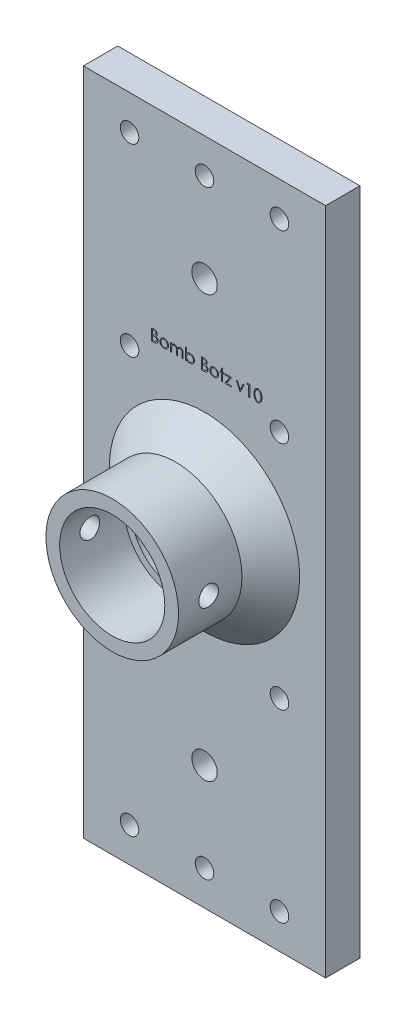
from build123d import *

# Parameters (mm, degrees)
BOSS_EXTRUDE1_DEPTH                     = 4.7625
BOSS_EXTRUDE1_DEPTH_BACK                = 4.699
SKETCH1_W                               = 66.675
SKETCH1_H                               = 184.15
SKETCH3_R                               = 6.35
CUT_EXTRUDE1_DEPTH                      = 0.508
SKETCH4_R                               = 18.25625
BOSS_EXTRUDE2_DEPTH                     = 38.1
SKETCH5_R                               = 12.461875
CUT_EXTRUDE2_DEPTH                      = 38.1
SKETCH7_R                               = 14.2875
CUT_EXTRUDE3_DEPTH                      = 30.48
F_10_CLEARANCE_HOLE1_D                  = 5.1054
SKETCH13_R                              = 14.478
CUT_EXTRUDE4_DEPTH                      = 30.48
CUT_EXTRUDE5_START                      = -12.7
SKETCH14_R                              = 18.25625
CUT_EXTRUDE5_DEPTH                      = 12.7
F_3_0_213_DIAMETER_HOLE1_D              = 5.4102
CBORE_FOR_M6_HEX_HEAD_BOLT1_D           = 7
CBORE_FOR_M6_HEX_HEAD_BOLT1_CBORE_D     = 14.55
CBORE_FOR_M6_HEX_HEAD_BOLT1_CBORE_DEPTH = 4.38
BOSS_EXTRUDE4_DEPTH                     = 1.27
CHAMFER1_SIZE                           = 7.9375
CUT_EXTRUDE6_DEPTH                      = 1.27


with BuildPart() as part:
    # Sketch1 → Boss-Extrude1 (new, two sides: drawn at the far end of the back side and taken through both)
    with BuildSketch(Plane.XY.offset(-BOSS_EXTRUDE1_DEPTH_BACK)):
        Rectangle(SKETCH1_W, SKETCH1_H)
    extrude(amount=BOSS_EXTRUDE1_DEPTH + BOSS_EXTRUDE1_DEPTH_BACK)

    # Sketch3 → Cut-Extrude1 (cut)
    with BuildSketch(Plane.XY.offset(4.7625)):
        Circle(SKETCH3_R)
    extrude(amount=-CUT_EXTRUDE1_DEPTH, mode=Mode.SUBTRACT)

    # Sketch4 → Boss-Extrude2 (add)
    with BuildSketch(Plane.XY.offset(4.7625)):
        with Locations(Location((0, 0, 0), (0, 0, 180))):
            Circle(SKETCH4_R)
    extrude(amount=BOSS_EXTRUDE2_DEPTH)

    # Sketch5 → Cut-Extrude2 (cut)
    with BuildSketch(Plane.XY.offset(42.8625)):
        Circle(SKETCH5_R)
    extrude(amount=-CUT_EXTRUDE2_DEPTH, mode=Mode.SUBTRACT)

    # Sketch7 → Cut-Extrude3 (cut)
    with BuildSketch(Plane.XY.offset(42.8625)):
        Circle(SKETCH7_R)
    extrude(amount=-CUT_EXTRUDE3_DEPTH, mode=Mode.SUBTRACT)

    # #10 Clearance Hole1 (through all)
    with Locations(Plane.XY.offset(4.7625)):
        with Locations((-20.6375, 82.55), (-20.6375, -82.55), (20.6375, -82.55), (20.6375, 82.55), (-20.6375, 31.75), (-20.6375, -31.75), (20.6375, -31.75), (20.6375, 31.75), (0, 82.55), (0, -82.55)):
            Hole(F_10_CLEARANCE_HOLE1_D / 2)

    # Sketch13 → Cut-Extrude4 (cut)
    with BuildSketch(Plane.XY.offset(42.8625)):
        Circle(SKETCH13_R)
    extrude(amount=-CUT_EXTRUDE4_DEPTH, mode=Mode.SUBTRACT)

    # Sketch14 → Cut-Extrude5 (cut)
    with BuildSketch(Plane.XY.offset(42.8625).offset(CUT_EXTRUDE5_START)):
        with Locations(Location((0, 0, 0), (0, 0, 180))):
            Circle(SKETCH14_R)
    extrude(amount=CUT_EXTRUDE5_DEPTH, mode=Mode.SUBTRACT)

    # #3 (0.213) Diameter Hole1 (through all)
    with Locations(Plane(origin=(18.25625, 0, 21.873504095), x_dir=(0, 1, 0), z_dir=(1, 0, 0))):
        with Locations((0, 0)):
            Hole(F_3_0_213_DIAMETER_HOLE1_D / 2)

    # CBORE for M6 Hex Head Bolt1 (through all)
    with Locations(Plane(origin=(0, 0, -4.699), x_dir=(-1, 0, 0), z_dir=(0, 0, -1))):
        with Locations((0, -58.039), (0, 58.039)):
            CounterBoreHole(CBORE_FOR_M6_HEX_HEAD_BOLT1_D / 2, CBORE_FOR_M6_HEX_HEAD_BOLT1_CBORE_D / 2, CBORE_FOR_M6_HEX_HEAD_BOLT1_CBORE_DEPTH)

    # Sketch28 → Boss-Extrude4 (add)
    # profile 1 of 11: a face of its own
    with BuildSketch(Plane.XY.offset(4.7625)):
        with BuildLine():
            Line((-15.150278343, 38.580814784), (-14.530797173, 38.580814784))
            add(Edge.make_bspline(
                [(-14.530797173, 38.580814784), (-14.500472768, 38.580655354), (-14.441696523, 38.580346337), (-14.35622603, 38.575553783), (-14.276171752, 38.569019025), (-14.201510472, 38.558650298), (-14.132276692, 38.546139186), (-14.068261764, 38.530988253), (-14.009669251, 38.512821253), (-13.939716983, 38.483932127), (-13.859960383, 38.441003253), (-13.773601841, 38.377568054), (-13.699756567, 38.299977891), (-13.636087551, 38.212454339), (-13.585467964, 38.116174032), (-13.548847244, 38.013431768), (-13.5256626, 37.905552759), (-13.523278235, 37.831490734), (-13.522073215, 37.794060978)],
                knots=[0, 0, 0, 0, 1.001505555, 1.941167018, 2.826882275, 3.653841531, 4.429895133, 5.150066043, 5.825578002, 6.45369114, 7.647487171, 8.808567382, 9.977351308, 11.170798116, 12.373658725, 13.556498008, 14.765093433, 16, 16, 16, 16], degree=3))
            add(Edge.make_bspline(
                [(-13.522073215, 37.794060978), (-13.52306492, 37.758997589), (-13.525013714, 37.690094721), (-13.543648932, 37.589316493), (-13.572823253, 37.493385031), (-13.6133773, 37.402650438), (-13.666084111, 37.319162803), (-13.728548443, 37.24224864), (-13.803910971, 37.175164467), (-13.860374481, 37.137660549), (-13.889055386, 37.118610257)],
                knots=[0, 0, 0, 0, 1.044552857, 2.05264487, 3.044412934, 4.028983338, 5.005914585, 5.980388656, 6.974128949, 8, 8, 8, 8], degree=3))
            add(Edge.make_bspline(
                [(-13.889055386, 37.118610257), (-13.852986998, 37.104762722), (-13.783979238, 37.078268958), (-13.689014069, 37.031428216), (-13.60719446, 36.980481159), (-13.537891334, 36.924844409), (-13.478620747, 36.864874273), (-13.426865579, 36.79969142), (-13.382704618, 36.728445546), (-13.344865038, 36.651879482), (-13.315338666, 36.570775043), (-13.293226238, 36.485892982), (-13.280555767, 36.397537671), (-13.278752692, 36.337407363), (-13.277842446, 36.307051764)],
                knots=[0, 0, 0, 0, 1.27268992, 2.434971085, 3.483601985, 4.442670788, 5.356604649, 6.2567628, 7.179492994, 8.113709626, 9.066344395, 10.018646069, 10.999752585, 12, 12, 12, 12], degree=3))
            add(Edge.make_bspline(
                [(-13.277842446, 36.307051764), (-13.278728584, 36.27605753), (-13.280472088, 36.215075506), (-13.293335348, 36.125490491), (-13.315115038, 36.039878932), (-13.345115292, 35.957687088), (-13.384269677, 35.879073966), (-13.431920045, 35.803950505), (-13.48873582, 35.733071505), (-13.552292851, 35.665649361), (-13.624194941, 35.605027011), (-13.701769947, 35.551037763), (-13.785994823, 35.506636693), (-13.875486274, 35.469338587), (-13.97124819, 35.440847772), (-14.072850555, 35.420915508), (-14.180205743, 35.407485225), (-14.253874589, 35.406381046), (-14.291654545, 35.405814784)],
                knots=[0, 0, 0, 0, 0.978564426, 1.925352924, 2.850884081, 3.763762016, 4.682927383, 5.618979971, 6.567305752, 7.547517671, 8.540179244, 9.531824382, 10.526200242, 11.540722885, 12.589160233, 13.674978461, 14.80764778, 16, 16, 16, 16], degree=3))
            Line((-14.291654545, 35.405814784), (-15.150278343, 35.405814784))
            Line((-15.150278343, 35.405814784), (-15.150278343, 38.580814784))
        make_face()
        with BuildLine():
            Line((-14.865342446, 38.255173759), (-14.865342446, 37.237545554))
            Line((-14.865342446, 37.237545554), (-14.673901139, 37.237545554))
            add(Edge.make_bspline(
                [(-14.673901139, 37.237545554), (-14.645916875, 37.237908341), (-14.591845573, 37.23860932), (-14.513541096, 37.240617296), (-14.440856258, 37.246239807), (-14.373916524, 37.251860702), (-14.312827307, 37.260999792), (-14.257723947, 37.271878361), (-14.207741648, 37.283383568), (-14.150102203, 37.302950173), (-14.084721743, 37.331867779), (-14.015023141, 37.376745802), (-13.953578301, 37.430198608), (-13.90169228, 37.491876123), (-13.859227589, 37.559790449), (-13.829733005, 37.632857976), (-13.809732968, 37.709257667), (-13.807926365, 37.761707082), (-13.807009112, 37.78833682)],
                knots=[0, 0, 0, 0, 1.156816544, 2.235205308, 3.236616184, 4.169592532, 5.011045266, 5.787822928, 6.49130361, 7.128639758, 8.301311294, 9.436451833, 10.541879658, 11.654887649, 12.756523258, 13.837046038, 14.901820046, 16, 16, 16, 16], degree=3))
            add(Edge.make_bspline(
                [(-13.807009112, 37.78833682), (-13.807486433, 37.80595877), (-13.808422749, 37.840526149), (-13.816091102, 37.890917348), (-13.829124545, 37.938309895), (-13.845865225, 37.983353267), (-13.86925925, 38.024639017), (-13.896803249, 38.06359463), (-13.930082411, 38.09889348), (-13.967962259, 38.131885811), (-14.011512938, 38.161136204), (-14.060708467, 38.186754611), (-14.116214431, 38.207383744), (-14.177095378, 38.225450539), (-14.244288436, 38.23813992), (-14.31701821, 38.248711207), (-14.395880419, 38.254093052), (-14.450440619, 38.254805488), (-14.478643728, 38.255173759)],
                knots=[0, 0, 0, 0, 0.91205012, 1.789085906, 2.630437955, 3.453916878, 4.269457761, 5.079663411, 5.91843418, 6.774407191, 7.675494373, 8.627863946, 9.638891023, 10.736472738, 11.911756761, 13.175263542, 14.539845004, 16, 16, 16, 16], degree=3))
            Line((-14.478643728, 38.255173759), (-14.865342446, 38.255173759))
        make_face(mode=Mode.SUBTRACT)
        with BuildLine():
            Line((-14.865342446, 36.911904528), (-14.865342446, 35.73145581))
            Line((-14.865342446, 35.73145581), (-14.459563199, 35.73145581))
            add(Edge.make_bspline(
                [(-14.459563199, 35.73145581), (-14.430517459, 35.731803924), (-14.374535624, 35.732474867), (-14.29370808, 35.734665213), (-14.218793407, 35.739647492), (-14.150133455, 35.747490512), (-14.08698683, 35.755998106), (-14.030111057, 35.767438339), (-13.979045089, 35.78054561), (-13.919831967, 35.800805895), (-13.853153784, 35.832280551), (-13.781298222, 35.879737028), (-13.717411581, 35.936273171), (-13.663159667, 36.001706215), (-13.618697885, 36.072854633), (-13.586353293, 36.148279343), (-13.566404445, 36.226734072), (-13.563989477, 36.280225304), (-13.562778343, 36.307051764)],
                knots=[0, 0, 0, 0, 1.160039823, 2.235823828, 3.228722157, 4.157150951, 4.99529583, 5.772374946, 6.472645482, 7.099169577, 8.269452708, 9.405989375, 10.527446681, 11.663510218, 12.788923519, 13.866172445, 14.929861265, 16, 16, 16, 16], degree=3))
            add(Edge.make_bspline(
                [(-13.562778343, 36.307051764), (-13.563028809, 36.323827865), (-13.563525701, 36.357109469), (-13.571019259, 36.406018819), (-13.581917555, 36.453395147), (-13.596006784, 36.499367097), (-13.616525872, 36.543103517), (-13.640480381, 36.585469411), (-13.668566795, 36.626520781), (-13.712331146, 36.678420468), (-13.77598716, 36.738216616), (-13.86643545, 36.79676135), (-13.96928032, 36.843976146), (-14.043872403, 36.864023528), (-14.082404745, 36.874379488)],
                knots=[0, 0, 0, 0, 0.723448775, 1.435228256, 2.130040452, 2.821711965, 3.505591119, 4.210454504, 4.921174351, 5.648778258, 7.137944449, 8.670945889, 10.280296675, 12, 12, 12, 12], degree=3))
            add(Edge.make_bspline(
                [(-14.082404745, 36.874379488), (-14.097852568, 36.877513743), (-14.131346634, 36.884309453), (-14.18596351, 36.89148287), (-14.248316763, 36.897873746), (-14.318550373, 36.90260101), (-14.3967532, 36.907487375), (-14.483092262, 36.909387677), (-14.577214969, 36.911654863), (-14.642522335, 36.911819177), (-14.67644521, 36.911904528)],
                knots=[0, 0, 0, 0, 0.634451884, 1.375622551, 2.216452059, 3.157844607, 4.20941857, 5.370758133, 6.634282058, 8, 8, 8, 8], degree=3))
            Line((-14.67644521, 36.911904528), (-14.865342446, 36.911904528))
        make_face(mode=Mode.SUBTRACT)
    # profile 2 of 11: a face of its own
    with BuildSketch(Plane.XY.offset(4.7625)):
        with BuildLine():
            add(Edge.make_bspline(
                [(-11.58730759, 37.76671222), (-11.543772649, 37.765785219), (-11.458411271, 37.763967596), (-11.333399831, 37.744541163), (-11.214069601, 37.714834625), (-11.099963555, 37.673766851), (-10.992543059, 37.618719653), (-10.89024343, 37.553034082), (-10.793345143, 37.475217015), (-10.73526711, 37.415020767), (-10.705787157, 37.384465626)],
                knots=[0, 0, 0, 0, 1.054011418, 2.066658804, 3.057071809, 4.030435133, 4.997543892, 5.974964718, 6.972108034, 8, 8, 8, 8], degree=3))
            add(Edge.make_bspline(
                [(-10.705787157, 37.384465626), (-10.680403527, 37.355242939), (-10.630127511, 37.297363104), (-10.565660752, 37.203514084), (-10.510124051, 37.106322707), (-10.465616936, 37.004498346), (-10.430524093, 36.898929894), (-10.405608783, 36.789254499), (-10.390788849, 36.675714369), (-10.388790443, 36.598603745), (-10.387778343, 36.559550762)],
                knots=[0, 0, 0, 0, 1.025258237, 2.030674902, 3.01204498, 3.988269485, 4.97094183, 5.956517959, 6.965070386, 8, 8, 8, 8], degree=3))
            add(Edge.make_bspline(
                [(-10.387778343, 36.559550762), (-10.388668556, 36.520271424), (-10.390427659, 36.44265362), (-10.407067939, 36.328336053), (-10.43294971, 36.217487892), (-10.46999002, 36.11057322), (-10.517486305, 36.007265226), (-10.575444286, 35.908015135), (-10.644270682, 35.812627129), (-10.722288593, 35.721911175), (-10.808514224, 35.638303252), (-10.902055301, 35.565434036), (-11.001073603, 35.503003082), (-11.106885788, 35.452714333), (-11.218525579, 35.413063391), (-11.336233777, 35.38521409), (-11.459827519, 35.368375991), (-11.544216499, 35.36621375), (-11.58730759, 35.365109656)],
                knots=[0, 0, 0, 0, 0.998656419, 1.973391657, 2.932242238, 3.890759089, 4.846373663, 5.82037756, 6.809684879, 7.83454468, 8.860553229, 9.859544525, 10.845671541, 11.83227036, 12.833544569, 13.85385346, 14.904124723, 16, 16, 16, 16], degree=3))
            add(Edge.make_bspline(
                [(-11.58730759, 35.365109656), (-11.6306098, 35.366217456), (-11.715419365, 35.368387137), (-11.839449363, 35.385148672), (-11.957368517, 35.413050556), (-12.06915446, 35.452844639), (-12.175421572, 35.503004689), (-12.275013608, 35.565245293), (-12.368630674, 35.638324863), (-12.454874546, 35.72190532), (-12.532887566, 35.812628637), (-12.601715224, 35.908014744), (-12.659672877, 36.007265328), (-12.707169248, 36.110573193), (-12.744209535, 36.217487899), (-12.770091312, 36.328336051), (-12.786731591, 36.442653621), (-12.788490694, 36.520271424), (-12.789380907, 36.559550762)],
                knots=[0, 0, 0, 0, 1.099876186, 2.154163076, 3.173186993, 4.173200201, 5.163417411, 6.152872554, 7.150605724, 8.17532212, 9.198891216, 10.186952605, 11.159729845, 12.11414092, 13.071450619, 14.029093627, 15.002601286, 16, 16, 16, 16], degree=3))
            add(Edge.make_bspline(
                [(-12.789380907, 36.559550762), (-12.788361904, 36.598391486), (-12.786344453, 36.675289444), (-12.77153942, 36.788616134), (-12.746721301, 36.898105909), (-12.711586391, 37.003266876), (-12.66666904, 37.104645022), (-12.611912728, 37.202076547), (-12.546788369, 37.295501195), (-12.496712313, 37.353306224), (-12.471372093, 37.382557573)],
                knots=[0, 0, 0, 0, 1.031353054, 2.041901799, 3.029428768, 4.008703097, 4.981709435, 5.96992636, 6.972712378, 8, 8, 8, 8], degree=3))
            add(Edge.make_bspline(
                [(-12.471372093, 37.382557573), (-12.441936585, 37.413377696), (-12.38404648, 37.473990892), (-12.286665849, 37.551581111), (-12.184617882, 37.618633549), (-12.076010271, 37.672586973), (-11.961997964, 37.7150762), (-11.842056223, 37.744617774), (-11.716620576, 37.763897603), (-11.630841492, 37.765764665), (-11.58730759, 37.76671222)],
                knots=[0, 0, 0, 0, 1.027980169, 2.021703884, 2.998553061, 3.971491411, 4.943284454, 5.930300938, 6.949603206, 8, 8, 8, 8], degree=3))
        make_face()
        with BuildLine():
            add(Edge.make_bspline(
                [(-11.588579625, 37.481776323), (-11.619365887, 37.4809013), (-11.680143668, 37.479173844), (-11.76960572, 37.466034873), (-11.855730002, 37.445218209), (-11.938679911, 37.415641672), (-12.018175717, 37.377451957), (-12.094293532, 37.330545087), (-12.167257245, 37.275542334), (-12.235639546, 37.212529767), (-12.298397786, 37.14369668), (-12.353259951, 37.070355668), (-12.399909869, 36.99369634), (-12.438772013, 36.913638977), (-12.46771639, 36.829372287), (-12.488737632, 36.741850572), (-12.501864208, 36.650895515), (-12.503575422, 36.589063734), (-12.50444501, 36.557642709)],
                knots=[0, 0, 0, 0, 1.021534396, 2.016698045, 2.994645724, 3.958388632, 4.93408049, 5.916473867, 6.921342795, 7.962252576, 8.998418191, 10.008913653, 10.997312074, 11.973003931, 12.956656626, 13.948281152, 14.957379055, 16, 16, 16, 16], degree=3))
            add(Edge.make_bspline(
                [(-12.50444501, 36.557642709), (-12.502987391, 36.517046227), (-12.500094291, 36.436469802), (-12.476567326, 36.317805427), (-12.437209772, 36.203884747), (-12.38406274, 36.095375597), (-12.317472813, 35.99498003), (-12.239016688, 35.905470898), (-12.149536389, 35.828195197), (-12.050098564, 35.764077573), (-11.942734289, 35.713132652), (-11.829108912, 35.677029295), (-11.71059914, 35.653559974), (-11.629608762, 35.65122728), (-11.588579625, 35.650045554)],
                knots=[0, 0, 0, 0, 1.016792936, 2.018143844, 3.017858371, 4.030088057, 5.03801393, 6.028138512, 7.003788237, 7.991172063, 8.984598303, 9.972568034, 10.972917682, 12, 12, 12, 12], degree=3))
            add(Edge.make_bspline(
                [(-11.588579625, 35.650045554), (-11.547552847, 35.651234165), (-11.466567128, 35.653580451), (-11.348222018, 35.676911095), (-11.234907201, 35.713290844), (-11.127654442, 35.764020277), (-11.02826188, 35.828438682), (-10.938138034, 35.905034538), (-10.860351794, 35.995217103), (-10.793827738, 36.095508576), (-10.739810336, 36.203716524), (-10.700637003, 36.317826452), (-10.677053479, 36.436464448), (-10.674168013, 36.517044433), (-10.67271424, 36.557642709)],
                knots=[0, 0, 0, 0, 1.02726834, 2.027799167, 3.010890988, 4.004497153, 4.992059811, 5.971914811, 6.958719428, 7.966827853, 8.981595046, 9.981490638, 10.983022906, 12, 12, 12, 12], degree=3))
            add(Edge.make_bspline(
                [(-10.67271424, 36.557642709), (-10.673583528, 36.589063922), (-10.675294154, 36.650896073), (-10.688425014, 36.741848441), (-10.709430397, 36.829380104), (-10.738433221, 36.913610135), (-10.777126505, 36.993903622), (-10.824676025, 37.070130588), (-10.879314169, 37.143950741), (-10.9428297, 37.212307258), (-11.011140621, 37.275566898), (-11.084133906, 37.330566416), (-11.160138851, 37.377245806), (-11.239403708, 37.415968324), (-11.322364252, 37.444949126), (-11.408367862, 37.46615507), (-11.497448211, 37.47911832), (-11.5580082, 37.480884655), (-11.588579625, 37.481776323)],
                knots=[0, 0, 0, 0, 1.042956736, 2.052379634, 3.044323526, 4.02829302, 5.004299113, 5.996692471, 7.007513377, 8.048758398, 9.090003419, 10.095195979, 11.07790575, 12.047570684, 13.018257071, 13.989683339, 14.985167495, 16, 16, 16, 16], degree=3))
        make_face(mode=Mode.SUBTRACT)
    # profile 3 of 11: a face of its own
    with BuildSketch(Plane.XY.offset(4.7625)):
        with BuildLine():
            Line((-9.817906548, 37.726007092), (-9.532970651, 37.726007092))
            Line((-9.532970651, 37.726007092), (-9.532970651, 37.322771916))
            add(Edge.make_bspline(
                [(-9.532970651, 37.322771916), (-9.507313068, 37.358048526), (-9.458150678, 37.425641893), (-9.377536837, 37.514714508), (-9.29700422, 37.590305048), (-9.23900751, 37.629986082), (-9.211145731, 37.649048959)],
                knots=[0, 0, 0, 0, 1.134379233, 2.173579362, 3.122582517, 4, 4, 4, 4], degree=3))
            add(Edge.make_bspline(
                [(-9.211145731, 37.649048959), (-9.173168502, 37.667196683), (-9.09787755, 37.70317507), (-8.978661538, 37.739672655), (-8.856673803, 37.762101854), (-8.77429778, 37.765169243), (-8.732860474, 37.76671222)],
                knots=[0, 0, 0, 0, 1.014936303, 2.012140481, 3.000054389, 4, 4, 4, 4], degree=3))
            add(Edge.make_bspline(
                [(-8.732860474, 37.76671222), (-8.704836113, 37.765763992), (-8.649377409, 37.7638875), (-8.567204699, 37.751677325), (-8.487504387, 37.730571583), (-8.410747375, 37.70117351), (-8.33842933, 37.665571158), (-8.272126986, 37.623797495), (-8.212596454, 37.576900862), (-8.159867822, 37.522763544), (-8.112452349, 37.459865344), (-8.068837967, 37.386509918), (-8.028537953, 37.301050112), (-8.006202908, 37.239031892), (-7.994444008, 37.20638069)],
                knots=[0, 0, 0, 0, 1.009824226, 1.998387844, 2.986035974, 3.974953746, 4.955485308, 5.885931332, 6.793869504, 7.679848016, 8.601185859, 9.625726857, 10.749998409, 12, 12, 12, 12], degree=3))
            add(Edge.make_bspline(
                [(-7.994444008, 37.20638069), (-7.982005944, 37.22880927), (-7.957529582, 37.272945567), (-7.916430897, 37.335409847), (-7.873370824, 37.393836009), (-7.827982391, 37.448270408), (-7.780425802, 37.498444235), (-7.730477246, 37.544523374), (-7.678421051, 37.586705711), (-7.606038091, 37.635984577), (-7.511865225, 37.688327791), (-7.393131007, 37.733710737), (-7.269623351, 37.761756082), (-7.185787296, 37.765049258), (-7.143452421, 37.76671222)],
                knots=[0, 0, 0, 0, 0.86119277, 1.694706429, 2.50939023, 3.298075842, 4.073795165, 4.829715201, 5.57930267, 6.321991688, 7.768977793, 9.186738141, 10.579381044, 12, 12, 12, 12], degree=3))
            add(Edge.make_bspline(
                [(-7.143452421, 37.76671222), (-7.104552809, 37.76524517), (-7.02842249, 37.76237401), (-6.917590256, 37.739828359), (-6.814228761, 37.701113636), (-6.718545985, 37.648287409), (-6.63222244, 37.581903436), (-6.557186931, 37.502919561), (-6.493895244, 37.411894468), (-6.452548907, 37.326267449), (-6.424504346, 37.250670397), (-6.407213083, 37.186257548), (-6.391937074, 37.115362925), (-6.379254087, 37.037901759), (-6.369984401, 36.953600421), (-6.36311668, 36.86259687), (-6.358468413, 36.764820375), (-6.358139962, 36.697360243), (-6.357970651, 36.662585618)],
                knots=[0, 0, 0, 0, 1.209669288, 2.367440248, 3.500751976, 4.631527125, 5.755587489, 6.87532382, 8.007944318, 9.190864318, 9.82315674, 10.514484317, 11.263564316, 12.079023757, 12.955305781, 13.901327259, 14.918167583, 16, 16, 16, 16], degree=3))
            Line((-6.357970651, 36.662585618), (-6.357970651, 35.405814784))
            Line((-6.357970651, 35.405814784), (-6.642906548, 35.405814784))
            Line((-6.642906548, 35.405814784), (-6.642906548, 36.663857653))
            add(Edge.make_bspline(
                [(-6.642906548, 36.663857653), (-6.642977199, 36.693539888), (-6.64311298, 36.750584629), (-6.645556488, 36.832456496), (-6.650160523, 36.907085648), (-6.655544088, 36.974370328), (-6.663022401, 37.034467444), (-6.672679782, 37.087256281), (-6.682910249, 37.133152095), (-6.699906469, 37.184030153), (-6.727073485, 37.240155272), (-6.768455056, 37.300683087), (-6.820588653, 37.35337067), (-6.880786795, 37.399107286), (-6.949320027, 37.436294375), (-7.024853026, 37.462851898), (-7.106916844, 37.479291938), (-7.163724659, 37.480930252), (-7.193061796, 37.481776323)],
                knots=[0, 0, 0, 0, 1.253487763, 2.409012846, 3.458416907, 4.410876679, 5.259312806, 6.014470957, 6.676830364, 7.243083969, 8.276244668, 9.299465089, 10.325150304, 11.392391894, 12.482080715, 13.603491619, 14.762376348, 16, 16, 16, 16], degree=3))
            add(Edge.make_bspline(
                [(-7.193061796, 37.481776323), (-7.229048112, 37.480491666), (-7.300170753, 37.477952695), (-7.403989158, 37.45203211), (-7.503748581, 37.412952169), (-7.596472308, 37.356317011), (-7.681768947, 37.288455138), (-7.755156421, 37.207765148), (-7.815782761, 37.116479428), (-7.856834582, 37.031982063), (-7.882769162, 36.956081924), (-7.899893222, 36.889772165), (-7.913213155, 36.814405315), (-7.925704993, 36.730487805), (-7.933858146, 36.637441999), (-7.941268026, 36.535698306), (-7.944734095, 36.424950714), (-7.945218925, 36.348182218), (-7.945470651, 36.308323799)],
                knots=[0, 0, 0, 0, 1.090531906, 2.155305635, 3.229839962, 4.33261226, 5.44038871, 6.529323825, 7.629011124, 8.757537029, 9.370236727, 10.061839251, 10.834451254, 11.692844982, 12.636905849, 13.66920014, 14.789842145, 16, 16, 16, 16], degree=3))
            Line((-7.945470651, 36.308323799), (-7.945470651, 35.405814784))
            Line((-7.945470651, 35.405814784), (-8.230406548, 35.405814784))
            Line((-8.230406548, 35.405814784), (-8.230406548, 36.585627485))
            add(Edge.make_bspline(
                [(-8.230406548, 36.585627485), (-8.230478603, 36.618913567), (-8.23061723, 36.682952643), (-8.233045033, 36.774786048), (-8.237659325, 36.858316743), (-8.242993822, 36.933447642), (-8.250668413, 37.000042204), (-8.25938584, 37.058457449), (-8.269680651, 37.10854693), (-8.286725761, 37.163486572), (-8.312773885, 37.224011981), (-8.354673237, 37.28854705), (-8.406931542, 37.34503311), (-8.46822798, 37.393255689), (-8.537175992, 37.43311689), (-8.613360934, 37.461836808), (-8.696096819, 37.478550271), (-8.753135881, 37.480680693), (-8.782469849, 37.481776323)],
                knots=[0, 0, 0, 0, 1.320475261, 2.540461679, 3.643808994, 4.639130445, 5.527981419, 6.302341397, 6.981980563, 7.553956391, 8.582137848, 9.585246428, 10.591171744, 11.620968678, 12.668337649, 13.738356861, 14.836885341, 16, 16, 16, 16], degree=3))
            add(Edge.make_bspline(
                [(-8.782469849, 37.481776323), (-8.816955984, 37.480387977), (-8.885685626, 37.477621053), (-8.986652413, 37.452716105), (-9.084157283, 37.413705265), (-9.176644759, 37.359585287), (-9.261620594, 37.292548265), (-9.336013808, 37.213704038), (-9.398554527, 37.124033844), (-9.440039817, 37.040427461), (-9.466799147, 36.966428847), (-9.484574915, 36.90351763), (-9.499850861, 36.833667405), (-9.511202866, 36.756662669), (-9.522161529, 36.673004962), (-9.527450452, 36.582277532), (-9.532595369, 36.48455821), (-9.532842488, 36.417091686), (-9.532970651, 36.382101844)],
                knots=[0, 0, 0, 0, 1.098833095, 2.189935336, 3.297829714, 4.440610912, 5.596351641, 6.740013378, 7.886572111, 9.072425424, 9.705826452, 10.395263256, 11.156850408, 11.985370555, 12.878090359, 13.847760091, 14.883794034, 16, 16, 16, 16], degree=3))
            Line((-9.532970651, 36.382101844), (-9.532970651, 35.405814784))
            Line((-9.532970651, 35.405814784), (-9.817906548, 35.405814784))
            Line((-9.817906548, 35.405814784), (-9.817906548, 37.726007092))
        make_face()
    # profile 4 of 11: a face of its own
    with BuildSketch(Plane.XY.offset(4.7625)):
        with BuildLine():
            Line((-5.706688599, 35.405814784), (-5.706688599, 38.662225041))
            Line((-5.706688599, 38.662225041), (-5.421752702, 38.662225041))
            Line((-5.421752702, 38.662225041), (-5.421752702, 37.304963422))
            add(Edge.make_bspline(
                [(-5.421752702, 37.304963422), (-5.389645815, 37.341936689), (-5.327003954, 37.414073057), (-5.221978173, 37.508277711), (-5.111845978, 37.588153886), (-4.99576956, 37.653999865), (-4.873583828, 37.704140923), (-4.745919701, 37.740809805), (-4.612450828, 37.76293221), (-4.521447006, 37.765441434), (-4.475358471, 37.76671222)],
                knots=[0, 0, 0, 0, 1.077089805, 2.101446609, 3.097517232, 4.067117542, 5.031729543, 5.997785507, 6.985986182, 8, 8, 8, 8], degree=3))
            add(Edge.make_bspline(
                [(-4.475358471, 37.76671222), (-4.434386332, 37.765587156), (-4.35337743, 37.763362713), (-4.234285768, 37.746458563), (-4.119701582, 37.7190467), (-4.009687245, 37.681044509), (-3.904756096, 37.630622808), (-3.804009666, 37.570260336), (-3.707964115, 37.498379852), (-3.618107184, 37.416194241), (-3.535290587, 37.326970733), (-3.462798524, 37.231557162), (-3.401566657, 37.131340473), (-3.350919698, 37.02665613), (-3.311757386, 36.917076583), (-3.284776901, 36.802709274), (-3.26763783, 36.683666715), (-3.265478606, 36.602647243), (-3.264380907, 36.561458815)],
                knots=[0, 0, 0, 0, 1.034377878, 2.045141349, 3.03070803, 4.00595497, 4.978199603, 5.965204761, 6.967410914, 8.002051993, 9.036360596, 10.037508045, 11.022711142, 11.997267194, 12.969246472, 13.954813154, 14.960274251, 16, 16, 16, 16], degree=3))
            add(Edge.make_bspline(
                [(-3.264380907, 36.561458815), (-3.265502535, 36.520909513), (-3.267714209, 36.440952676), (-3.284606396, 36.3232903), (-3.31249765, 36.210043766), (-3.352376724, 36.101505704), (-3.402509918, 35.997166211), (-3.465203718, 35.898214702), (-3.537603696, 35.802929345), (-3.621361238, 35.714370765), (-3.711997104, 35.632516181), (-3.808983596, 35.56139086), (-3.909877768, 35.499961758), (-4.016252162, 35.451288602), (-4.126531743, 35.411917767), (-4.241897987, 35.384596718), (-4.361698201, 35.368655447), (-4.443086049, 35.366300897), (-4.484262718, 35.365109656)],
                knots=[0, 0, 0, 0, 1.024244038, 2.01964794, 2.996620209, 3.965911562, 4.936179293, 5.91563013, 6.920572822, 7.955171681, 8.990768464, 10.002129126, 10.989675881, 11.969873457, 12.952483066, 13.943799762, 14.959703725, 16, 16, 16, 16], degree=3))
            add(Edge.make_bspline(
                [(-4.484262718, 35.365109656), (-4.531402498, 35.366416494), (-4.623835388, 35.368978974), (-4.759047449, 35.390223334), (-4.887028569, 35.426383509), (-5.009236631, 35.474971673), (-5.123924636, 35.540765523), (-5.231820736, 35.622369147), (-5.33224451, 35.721127192), (-5.391405478, 35.796475829), (-5.421752702, 35.835126684)],
                knots=[0, 0, 0, 0, 1.035807596, 2.031038093, 2.998900396, 3.954262848, 4.914341711, 5.895762244, 6.92060972, 8, 8, 8, 8], degree=3))
            Line((-5.421752702, 35.835126684), (-5.421752702, 35.405814784))
            Line((-5.421752702, 35.405814784), (-5.706688599, 35.405814784))
        make_face()
        with BuildLine():
            add(Edge.make_bspline(
                [(-4.486806788, 35.650045554), (-4.445155912, 35.651527488), (-4.362943705, 35.654452592), (-4.242253981, 35.677288664), (-4.126761805, 35.715283539), (-4.017049152, 35.767248046), (-3.914832919, 35.83258232), (-3.823526601, 35.911636347), (-3.742355722, 36.001898435), (-3.674635897, 36.103710428), (-3.618097089, 36.212069521), (-3.579259331, 36.326055923), (-3.553206441, 36.442619054), (-3.550618999, 36.521672965), (-3.549316804, 36.561458815)],
                knots=[0, 0, 0, 0, 1.031910345, 2.036826888, 3.032245421, 4.038315463, 5.03827337, 6.029480047, 7.023177075, 8.037597977, 9.052889626, 10.043399556, 11.015292101, 12, 12, 12, 12], degree=3))
            add(Edge.make_bspline(
                [(-3.549316804, 36.561458815), (-3.551029258, 36.601205771), (-3.554447328, 36.680541002), (-3.578373024, 36.798151772), (-3.620154019, 36.912077689), (-3.675596797, 37.022003435), (-3.744419898, 37.124517654), (-3.825161022, 37.216583698), (-3.917582375, 37.296013112), (-4.019929334, 37.362225534), (-4.128949935, 37.416254557), (-4.24369501, 37.45330683), (-4.361767021, 37.477562186), (-4.441954361, 37.480364467), (-4.482354665, 37.481776323)],
                knots=[0, 0, 0, 0, 0.984795267, 1.965658976, 2.959410029, 3.983795688, 5.009594896, 6.01088574, 7.009236619, 8.019050059, 9.024672985, 10.014834719, 10.999826153, 12, 12, 12, 12], degree=3))
            add(Edge.make_bspline(
                [(-4.482354665, 37.481776323), (-4.52360019, 37.480365265), (-4.605464187, 37.4775646), (-4.726266789, 37.453264217), (-4.844252767, 37.416028169), (-4.956999314, 37.362569017), (-5.062095493, 37.29715362), (-5.156086934, 37.220282154), (-5.237123419, 37.132488951), (-5.303838125, 37.034058688), (-5.356819621, 36.92775512), (-5.39472345, 36.814351193), (-5.417401701, 36.69444386), (-5.420284721, 36.612226594), (-5.421752702, 36.570363062)],
                knots=[0, 0, 0, 0, 1.016820015, 2.018181405, 3.029022337, 4.06341356, 5.088169224, 6.076823655, 7.05054209, 8.02560866, 9.001194327, 9.972267242, 10.967515442, 12, 12, 12, 12], degree=3))
            add(Edge.make_bspline(
                [(-5.421752702, 36.570363062), (-5.420882144, 36.538306612), (-5.41916861, 36.475209375), (-5.406078204, 36.38256497), (-5.385254139, 36.293907093), (-5.35591397, 36.209139133), (-5.317359278, 36.128742291), (-5.270904252, 36.052092276), (-5.215612401, 35.979880731), (-5.15310428, 35.91228469), (-5.084195549, 35.850771864), (-5.010242435, 35.797451617), (-4.932756169, 35.751537316), (-4.850850267, 35.71493878), (-4.765477882, 35.685069722), (-4.675762958, 35.66535411), (-4.582625309, 35.651769611), (-4.519082585, 35.65062629), (-4.486806788, 35.650045554)],
                knots=[0, 0, 0, 0, 1.050331198, 2.067384183, 3.060053655, 4.031335885, 5.001026174, 5.976994447, 6.963687968, 7.976578778, 8.990422448, 9.985569286, 10.960374351, 11.936812464, 12.921228065, 13.919088064, 14.943024695, 16, 16, 16, 16], degree=3))
        make_face(mode=Mode.SUBTRACT)
    # profile 5 of 11: a face of its own
    with BuildSketch(Plane.XY.offset(4.7625)):
        with BuildLine():
            Line((-1.39194501, 38.580814784), (-0.77246384, 38.580814784))
            add(Edge.make_bspline(
                [(-0.77246384, 38.580814784), (-0.742139435, 38.580655354), (-0.68336319, 38.580346337), (-0.597892697, 38.575553783), (-0.517838418, 38.569019025), (-0.443177139, 38.558650298), (-0.373943359, 38.546139186), (-0.309928431, 38.530988253), (-0.251335918, 38.512821253), (-0.18138365, 38.483932127), (-0.10162705, 38.441003253), (-0.015268508, 38.377568054), (0.058576766, 38.299977891), (0.122245783, 38.212454339), (0.17286537, 38.116174032), (0.209486089, 38.013431768), (0.232670733, 37.905552759), (0.235055099, 37.831490734), (0.236260119, 37.794060978)],
                knots=[0, 0, 0, 0, 1.001505555, 1.941167018, 2.826882275, 3.653841531, 4.429895133, 5.150066043, 5.825578002, 6.45369114, 7.647487171, 8.808567382, 9.977351308, 11.170798116, 12.373658725, 13.556498008, 14.765093433, 16, 16, 16, 16], degree=3))
            add(Edge.make_bspline(
                [(0.236260119, 37.794060978), (0.235268413, 37.758997589), (0.233319619, 37.690094721), (0.214684401, 37.589316493), (0.185510081, 37.493385031), (0.144956033, 37.402650438), (0.092249222, 37.319162803), (0.029784891, 37.24224864), (-0.045577637, 37.175164467), (-0.102041148, 37.137660549), (-0.130722053, 37.118610257)],
                knots=[0, 0, 0, 0, 1.044552857, 2.05264487, 3.044412934, 4.028983338, 5.005914585, 5.980388656, 6.974128949, 8, 8, 8, 8], degree=3))
            add(Edge.make_bspline(
                [(-0.130722053, 37.118610257), (-0.094653665, 37.104762722), (-0.025645904, 37.078268958), (0.069319264, 37.031428216), (0.151138874, 36.980481159), (0.220441999, 36.924844409), (0.279712586, 36.864874273), (0.331467754, 36.79969142), (0.375628715, 36.728445546), (0.413468296, 36.651879482), (0.442994667, 36.570775043), (0.465107095, 36.485892982), (0.477777567, 36.397537671), (0.479580641, 36.337407363), (0.480490888, 36.307051764)],
                knots=[0, 0, 0, 0, 1.27268992, 2.434971085, 3.483601985, 4.442670788, 5.356604649, 6.2567628, 7.179492994, 8.113709626, 9.066344395, 10.018646069, 10.999752585, 12, 12, 12, 12], degree=3))
            add(Edge.make_bspline(
                [(0.480490888, 36.307051764), (0.479604749, 36.27605753), (0.477861246, 36.215075506), (0.464997986, 36.125490491), (0.443218296, 36.039878932), (0.413218042, 35.957687088), (0.374063656, 35.879073966), (0.326413289, 35.803950505), (0.269597513, 35.733071505), (0.206040482, 35.665649361), (0.134138393, 35.605027011), (0.056563386, 35.551037763), (-0.027661489, 35.506636693), (-0.117152941, 35.469338587), (-0.212914856, 35.440847772), (-0.314517222, 35.420915508), (-0.42187241, 35.407485225), (-0.495541255, 35.406381046), (-0.533321212, 35.405814784)],
                knots=[0, 0, 0, 0, 0.978564426, 1.925352924, 2.850884081, 3.763762016, 4.682927383, 5.618979971, 6.567305752, 7.547517671, 8.540179244, 9.531824382, 10.526200242, 11.540722885, 12.589160233, 13.674978461, 14.80764778, 16, 16, 16, 16], degree=3))
            Line((-0.533321212, 35.405814784), (-1.39194501, 35.405814784))
            Line((-1.39194501, 35.405814784), (-1.39194501, 38.580814784))
        make_face()
        with BuildLine():
            Line((-1.107009112, 38.255173759), (-1.107009112, 37.237545554))
            Line((-1.107009112, 37.237545554), (-0.915567806, 37.237545554))
            add(Edge.make_bspline(
                [(-0.915567806, 37.237545554), (-0.887583542, 37.237908341), (-0.83351224, 37.23860932), (-0.755207763, 37.240617296), (-0.682522925, 37.246239807), (-0.61558319, 37.251860702), (-0.554493973, 37.260999792), (-0.499390613, 37.271878361), (-0.449408315, 37.283383568), (-0.39176887, 37.302950173), (-0.326388409, 37.331867779), (-0.256689808, 37.376745802), (-0.195244967, 37.430198608), (-0.143358947, 37.491876123), (-0.100894256, 37.559790449), (-0.071399672, 37.632857976), (-0.051399635, 37.709257667), (-0.049593032, 37.761707082), (-0.048675779, 37.78833682)],
                knots=[0, 0, 0, 0, 1.156816544, 2.235205308, 3.236616184, 4.169592532, 5.011045266, 5.787822928, 6.49130361, 7.128639758, 8.301311294, 9.436451833, 10.541879658, 11.654887649, 12.756523258, 13.837046038, 14.901820046, 16, 16, 16, 16], degree=3))
            add(Edge.make_bspline(
                [(-0.048675779, 37.78833682), (-0.049153099, 37.80595877), (-0.050089416, 37.840526149), (-0.057757769, 37.890917348), (-0.070791212, 37.938309895), (-0.087531892, 37.983353267), (-0.110925917, 38.024639017), (-0.138469915, 38.06359463), (-0.171749077, 38.09889348), (-0.209628925, 38.131885811), (-0.253179605, 38.161136204), (-0.302375134, 38.186754611), (-0.357881098, 38.207383744), (-0.418762045, 38.225450539), (-0.485955103, 38.23813992), (-0.558684876, 38.248711207), (-0.637547086, 38.254093052), (-0.692107286, 38.254805488), (-0.720310394, 38.255173759)],
                knots=[0, 0, 0, 0, 0.91205012, 1.789085906, 2.630437955, 3.453916878, 4.269457761, 5.079663411, 5.91843418, 6.774407191, 7.675494373, 8.627863946, 9.638891023, 10.736472738, 11.911756761, 13.175263542, 14.539845004, 16, 16, 16, 16], degree=3))
            Line((-0.720310394, 38.255173759), (-1.107009112, 38.255173759))
        make_face(mode=Mode.SUBTRACT)
        with BuildLine():
            Line((-1.107009112, 36.911904528), (-1.107009112, 35.73145581))
            Line((-1.107009112, 35.73145581), (-0.701229865, 35.73145581))
            add(Edge.make_bspline(
                [(-0.701229865, 35.73145581), (-0.672184125, 35.731803924), (-0.616202291, 35.732474867), (-0.535374746, 35.734665213), (-0.460460074, 35.739647492), (-0.391800122, 35.747490512), (-0.328653497, 35.755998106), (-0.271777724, 35.767438339), (-0.220711755, 35.78054561), (-0.161498633, 35.800805895), (-0.094820451, 35.832280551), (-0.022964888, 35.879737028), (0.040921753, 35.936273171), (0.095173666, 36.001706215), (0.139635449, 36.072854633), (0.17198004, 36.148279343), (0.191928889, 36.226734072), (0.194343857, 36.280225304), (0.19555499, 36.307051764)],
                knots=[0, 0, 0, 0, 1.160039823, 2.235823828, 3.228722157, 4.157150951, 4.99529583, 5.772374946, 6.472645482, 7.099169577, 8.269452708, 9.405989375, 10.527446681, 11.663510218, 12.788923519, 13.866172445, 14.929861265, 16, 16, 16, 16], degree=3))
            add(Edge.make_bspline(
                [(0.19555499, 36.307051764), (0.195304524, 36.323827865), (0.194807632, 36.357109469), (0.187314074, 36.406018819), (0.176415778, 36.453395147), (0.162326549, 36.499367097), (0.141807461, 36.543103517), (0.117852952, 36.585469411), (0.089766538, 36.626520781), (0.046002187, 36.678420468), (-0.017653827, 36.738216616), (-0.108102116, 36.79676135), (-0.210946987, 36.843976146), (-0.285539069, 36.864023528), (-0.324071412, 36.874379488)],
                knots=[0, 0, 0, 0, 0.723448775, 1.435228256, 2.130040452, 2.821711965, 3.505591119, 4.210454504, 4.921174351, 5.648778258, 7.137944449, 8.670945889, 10.280296675, 12, 12, 12, 12], degree=3))
            add(Edge.make_bspline(
                [(-0.324071412, 36.874379488), (-0.339519235, 36.877513743), (-0.3730133, 36.884309453), (-0.427630177, 36.89148287), (-0.489983429, 36.897873746), (-0.56021704, 36.90260101), (-0.638419867, 36.907487375), (-0.724758929, 36.909387677), (-0.818881636, 36.911654863), (-0.884189002, 36.911819177), (-0.918111877, 36.911904528)],
                knots=[0, 0, 0, 0, 0.634451884, 1.375622551, 2.216452059, 3.157844607, 4.20941857, 5.370758133, 6.634282058, 8, 8, 8, 8], degree=3))
            Line((-0.918111877, 36.911904528), (-1.107009112, 36.911904528))
        make_face(mode=Mode.SUBTRACT)
    # profile 6 of 11: a face of its own
    with BuildSketch(Plane.XY.offset(4.7625)):
        with BuildLine():
            add(Edge.make_bspline(
                [(2.171025744, 37.76671222), (2.214560684, 37.765785219), (2.299922063, 37.763967596), (2.424933502, 37.744541163), (2.544263732, 37.714834625), (2.658369778, 37.673766851), (2.765790275, 37.618719653), (2.868089903, 37.553034082), (2.96498819, 37.475217015), (3.023066224, 37.415020767), (3.052546176, 37.384465626)],
                knots=[0, 0, 0, 0, 1.054011418, 2.066658804, 3.057071809, 4.030435133, 4.997543892, 5.974964718, 6.972108034, 8, 8, 8, 8], degree=3))
            add(Edge.make_bspline(
                [(3.052546176, 37.384465626), (3.077929806, 37.355242939), (3.128205822, 37.297363104), (3.192672582, 37.203514084), (3.248209283, 37.106322707), (3.292716397, 37.004498346), (3.32780924, 36.898929894), (3.35272455, 36.789254499), (3.367544484, 36.675714369), (3.36954289, 36.598603745), (3.37055499, 36.559550762)],
                knots=[0, 0, 0, 0, 1.025258237, 2.030674902, 3.01204498, 3.988269485, 4.97094183, 5.956517959, 6.965070386, 8, 8, 8, 8], degree=3))
            add(Edge.make_bspline(
                [(3.37055499, 36.559550762), (3.369664777, 36.520271424), (3.367905675, 36.44265362), (3.351265394, 36.328336053), (3.325383623, 36.217487892), (3.288343313, 36.11057322), (3.240847028, 36.007265226), (3.182889047, 35.908015135), (3.114062652, 35.812627129), (3.03604474, 35.721911175), (2.94981911, 35.638303252), (2.856278032, 35.565434036), (2.75725973, 35.503003082), (2.651447546, 35.452714333), (2.539807754, 35.413063391), (2.422099556, 35.38521409), (2.298505814, 35.368375991), (2.214116835, 35.36621375), (2.171025744, 35.365109656)],
                knots=[0, 0, 0, 0, 0.998656419, 1.973391657, 2.932242238, 3.890759089, 4.846373663, 5.82037756, 6.809684879, 7.83454468, 8.860553229, 9.859544525, 10.845671541, 11.83227036, 12.833544569, 13.85385346, 14.904124723, 16, 16, 16, 16], degree=3))
            add(Edge.make_bspline(
                [(2.171025744, 35.365109656), (2.127723534, 35.366217456), (2.042913968, 35.368387137), (1.91888397, 35.385148672), (1.800964816, 35.413050556), (1.689178873, 35.452844639), (1.582911762, 35.503004689), (1.483319725, 35.565245293), (1.389702659, 35.638324863), (1.303458788, 35.72190532), (1.225445767, 35.812628637), (1.156618109, 35.908014744), (1.098660456, 36.007265328), (1.051164086, 36.110573193), (1.014123798, 36.217487899), (0.988242021, 36.328336051), (0.971601742, 36.442653621), (0.96984264, 36.520271424), (0.968952426, 36.559550762)],
                knots=[0, 0, 0, 0, 1.099876186, 2.154163076, 3.173186993, 4.173200201, 5.163417411, 6.152872554, 7.150605724, 8.17532212, 9.198891216, 10.186952605, 11.159729845, 12.11414092, 13.071450619, 14.029093627, 15.002601286, 16, 16, 16, 16], degree=3))
            add(Edge.make_bspline(
                [(0.968952426, 36.559550762), (0.969971429, 36.598391486), (0.97198888, 36.675289444), (0.986793913, 36.788616134), (1.011612032, 36.898105909), (1.046746942, 37.003266876), (1.091664294, 37.104645022), (1.146420605, 37.202076547), (1.211544964, 37.295501195), (1.26162102, 37.353306224), (1.28696124, 37.382557573)],
                knots=[0, 0, 0, 0, 1.031353054, 2.041901799, 3.029428768, 4.008703097, 4.981709435, 5.96992636, 6.972712378, 8, 8, 8, 8], degree=3))
            add(Edge.make_bspline(
                [(1.28696124, 37.382557573), (1.316396748, 37.413377696), (1.374286853, 37.473990892), (1.471667485, 37.551581111), (1.573715451, 37.618633549), (1.682323062, 37.672586973), (1.796335369, 37.7150762), (1.916277111, 37.744617774), (2.041712757, 37.763897603), (2.127491842, 37.765764665), (2.171025744, 37.76671222)],
                knots=[0, 0, 0, 0, 1.027980169, 2.021703884, 2.998553061, 3.971491411, 4.943284454, 5.930300938, 6.949603206, 8, 8, 8, 8], degree=3))
        make_face()
        with BuildLine():
            add(Edge.make_bspline(
                [(2.169753708, 37.481776323), (2.138967447, 37.4809013), (2.078189666, 37.479173844), (1.988727614, 37.466034873), (1.902603331, 37.445218209), (1.819653423, 37.415641672), (1.740157616, 37.377451957), (1.664039801, 37.330545087), (1.591076088, 37.275542334), (1.522693788, 37.212529767), (1.459935547, 37.14369668), (1.405073383, 37.070355668), (1.358423465, 36.99369634), (1.319561321, 36.913638977), (1.290616943, 36.829372287), (1.269595701, 36.741850572), (1.256469126, 36.650895515), (1.254757911, 36.589063734), (1.253888324, 36.557642709)],
                knots=[0, 0, 0, 0, 1.021534396, 2.016698045, 2.994645724, 3.958388632, 4.93408049, 5.916473867, 6.921342795, 7.962252576, 8.998418191, 10.008913653, 10.997312074, 11.973003931, 12.956656626, 13.948281152, 14.957379055, 16, 16, 16, 16], degree=3))
            add(Edge.make_bspline(
                [(1.253888324, 36.557642709), (1.255345942, 36.517046227), (1.258239043, 36.436469802), (1.281766007, 36.317805427), (1.321123561, 36.203884747), (1.374270593, 36.095375597), (1.44086052, 35.99498003), (1.519316645, 35.905470898), (1.608796945, 35.828195197), (1.70823477, 35.764077573), (1.815599044, 35.713132652), (1.929224421, 35.677029295), (2.047734193, 35.653559974), (2.128724571, 35.65122728), (2.169753708, 35.650045554)],
                knots=[0, 0, 0, 0, 1.016792936, 2.018143844, 3.017858371, 4.030088057, 5.03801393, 6.028138512, 7.003788237, 7.991172063, 8.984598303, 9.972568034, 10.972917682, 12, 12, 12, 12], degree=3))
            add(Edge.make_bspline(
                [(2.169753708, 35.650045554), (2.210780486, 35.651234165), (2.291766205, 35.653580451), (2.410111315, 35.676911095), (2.523426133, 35.713290844), (2.630678891, 35.764020277), (2.730071453, 35.828438682), (2.820195299, 35.905034538), (2.897981539, 35.995217103), (2.964505595, 36.095508576), (3.018522997, 36.203716524), (3.05769633, 36.317826452), (3.081279855, 36.436464448), (3.084165321, 36.517044433), (3.085619093, 36.557642709)],
                knots=[0, 0, 0, 0, 1.02726834, 2.027799167, 3.010890988, 4.004497153, 4.992059811, 5.971914811, 6.958719428, 7.966827853, 8.981595046, 9.981490638, 10.983022906, 12, 12, 12, 12], degree=3))
            add(Edge.make_bspline(
                [(3.085619093, 36.557642709), (3.084749805, 36.589063922), (3.083039179, 36.650896073), (3.069908319, 36.741848441), (3.048902936, 36.829380104), (3.019900112, 36.913610135), (2.981206828, 36.993903622), (2.933657309, 37.070130588), (2.879019164, 37.143950741), (2.815503633, 37.212307258), (2.747192712, 37.275566898), (2.674199427, 37.330566416), (2.598194482, 37.377245806), (2.518929625, 37.415968324), (2.435969082, 37.444949126), (2.349965472, 37.46615507), (2.260885123, 37.47911832), (2.200325134, 37.480884655), (2.169753708, 37.481776323)],
                knots=[0, 0, 0, 0, 1.042956736, 2.052379634, 3.044323526, 4.02829302, 5.004299113, 5.996692471, 7.007513377, 8.048758398, 9.090003419, 10.095195979, 11.07790575, 12.047570684, 13.018257071, 13.989683339, 14.985167495, 16, 16, 16, 16], degree=3))
        make_face(mode=Mode.SUBTRACT)
    # profile 7 of 11: a face of its own
    with BuildSketch(Plane.XY.offset(4.7625)):
        Polygon((4.225362683, 38.662225041), (4.51029858, 38.662225041), (4.51029858, 37.726007092), (4.917349862, 37.726007092), (4.917349862, 37.441071195), (4.51029858, 37.441071195), (4.51029858, 35.405814784), (4.225362683, 35.405814784), (4.225362683, 37.441071195), (3.818311401, 37.441071195), (3.818311401, 37.726007092), (4.225362683, 37.726007092), align=None)
    # profile 8 of 11: a face of its own
    with BuildSketch(Plane.XY.offset(4.7625)):
        Polygon((5.20228576, 37.726007092), (6.952606272, 37.726007092), (5.602976865, 35.690750682), (6.911901144, 35.690750682), (6.911901144, 35.405814784), (5.080170375, 35.405814784), (6.4304358, 37.441071195), (5.20228576, 37.441071195), align=None)
    # profile 9 of 11: a face of its own
    with BuildSketch(Plane.XY.offset(4.7625)):
        Polygon((8.255170375, 37.726007092), (8.563638925, 37.726007092), (9.333856272, 36.036744272), (10.10407362, 37.726007092), (10.41254217, 37.726007092), (9.354208837, 35.405814784), (9.313503708, 35.405814784), align=None)
    # profile 10 of 11: a face of its own
    with BuildSketch(Plane.XY.offset(4.7625)):
        Polygon((11.372292771, 38.580814784), (11.959337042, 38.580814784), (11.959337042, 35.405814784), (11.674401144, 35.405814784), (11.674401144, 38.255173759), (11.185939606, 38.255173759), align=None)
    # profile 11 of 11: a face of its own
    with BuildSketch(Plane.XY.offset(4.7625)):
        with BuildLine():
            add(Edge.make_bspline(
                [(13.13978576, 36.992042749), (13.140083319, 37.042931094), (13.140661332, 37.141782437), (13.147091543, 37.285822791), (13.15777346, 37.420951053), (13.172412363, 37.547173691), (13.190226816, 37.664523292), (13.214008008, 37.77268625), (13.241052479, 37.872163179), (13.272396483, 37.963278466), (13.307763977, 38.047259668), (13.346257914, 38.125659672), (13.389405977, 38.198359853), (13.434742177, 38.266520563), (13.484101699, 38.329026058), (13.536079888, 38.386759044), (13.592705447, 38.438385225), (13.652053461, 38.485417228), (13.714661254, 38.526646392), (13.778744244, 38.562961805), (13.844743519, 38.59398597), (13.91283927, 38.618379437), (13.982419448, 38.638527848), (14.053727287, 38.652306393), (14.126880524, 38.660975874), (14.176257612, 38.661804702), (14.201299181, 38.662225041)],
                knots=[0, 0, 0, 0, 1.646270934, 3.197905019, 4.663502075, 6.030701355, 7.308322542, 8.50163776, 9.611534131, 10.641858119, 11.616356847, 12.558055219, 13.465016945, 14.349605745, 15.204443733, 16.039544428, 16.859896111, 17.680448484, 18.487036065, 19.28249412, 20.06191084, 20.843045899, 21.620316918, 22.403196591, 23.190181807, 24, 24, 24, 24], degree=3))
            add(Edge.make_bspline(
                [(14.201299181, 38.662225041), (14.226549937, 38.661782523), (14.276765745, 38.660902494), (14.351006656, 38.652444346), (14.423532439, 38.638409827), (14.494033894, 38.618524371), (14.563090131, 38.593854008), (14.630161015, 38.562932123), (14.695663154, 38.526937722), (14.758555629, 38.484643204), (14.819528887, 38.437487854), (14.877085253, 38.384181719), (14.931229967, 38.325263045), (14.982642566, 38.261362211), (15.029864429, 38.191253598), (15.074834614, 38.116156584), (15.115086389, 38.034757871), (15.153852844, 37.94841559), (15.187314611, 37.854740699), (15.217491848, 37.754261238), (15.241874912, 37.645790369), (15.262185181, 37.529897203), (15.277919479, 37.406156129), (15.28937909, 37.2748324), (15.295432531, 37.135839617), (15.296572539, 37.040809282), (15.297157554, 36.992042749)],
                knots=[0, 0, 0, 0, 0.810914788, 1.612654377, 2.396697861, 3.181598691, 3.963628158, 4.749916497, 5.551656086, 6.361998678, 7.18212741, 8.025565596, 8.878627764, 9.750805457, 10.657531673, 11.591944965, 12.560506719, 13.57287815, 14.630710178, 15.753379473, 16.941251878, 18.199788006, 19.531962791, 20.947069417, 22.433333509, 24, 24, 24, 24], degree=3))
            add(Edge.make_bspline(
                [(15.297157554, 36.992042749), (15.296566474, 36.943488918), (15.295414778, 36.848883759), (15.289446952, 36.710516375), (15.277691622, 36.579889578), (15.262986847, 36.456690087), (15.242620616, 36.341430676), (15.217578787, 36.233712498), (15.189774565, 36.133070375), (15.155453002, 36.040328796), (15.117887572, 35.954194019), (15.077016073, 35.873760249), (15.033228445, 35.79831654), (14.98552294, 35.72846677), (14.934674487, 35.663716131), (14.879594778, 35.605207573), (14.821836462, 35.551531321), (14.76068377, 35.503768773), (14.696810435, 35.461963272), (14.631533272, 35.424576422), (14.56369406, 35.39442962), (14.494830167, 35.368544261), (14.423956578, 35.348768137), (14.351161638, 35.335093997), (14.276815624, 35.32550382), (14.22655849, 35.324772228), (14.201299181, 35.324404528)],
                knots=[0, 0, 0, 0, 1.561518951, 3.042555995, 4.452378317, 5.7783523, 7.031515105, 8.214008947, 9.334062868, 10.386615937, 11.391082383, 12.354592575, 13.286541444, 14.194233754, 15.072674879, 15.931287219, 16.775624067, 17.606195743, 18.42308326, 19.229000347, 20.022332153, 20.807536673, 21.593273796, 22.3848459, 23.188221202, 24, 24, 24, 24], degree=3))
            add(Edge.make_bspline(
                [(14.201299181, 35.324404528), (14.176258306, 35.324827579), (14.126882589, 35.325661753), (14.053719317, 35.334292067), (13.982705958, 35.348167273), (13.913492088, 35.367595193), (13.845722606, 35.391375794), (13.780320975, 35.422358064), (13.716560005, 35.458039684), (13.654609808, 35.498675531), (13.59563449, 35.545231629), (13.539302184, 35.596724948), (13.487028059, 35.654440471), (13.438374273, 35.717466873), (13.392133493, 35.785224314), (13.349598132, 35.858637909), (13.310254572, 35.937416563), (13.274292263, 36.022069239), (13.242407404, 36.11383121), (13.214242697, 36.21375225), (13.192004854, 36.322714291), (13.172970316, 36.439842189), (13.157617483, 36.565639254), (13.147136059, 36.700173782), (13.140657866, 36.843361935), (13.140081767, 36.941578088), (13.13978576, 36.992042749)],
                knots=[0, 0, 0, 0, 0.810891512, 1.598919785, 2.382837074, 3.152667961, 3.926044502, 4.706494248, 5.493654104, 6.291793342, 7.103789334, 7.925228297, 8.761435821, 9.622817696, 10.50288917, 11.416980706, 12.369136599, 13.353924996, 14.394355917, 15.514179734, 16.714354668, 17.994756427, 19.357759367, 20.818452758, 22.365282078, 24, 24, 24, 24], degree=3))
        make_face()
        with BuildLine():
            add(Edge.make_bspline(
                [(13.424721657, 36.993314784), (13.424830013, 36.950907036), (13.425040309, 36.868601924), (13.430534149, 36.749001252), (13.438018288, 36.637449596), (13.447671464, 36.533805317), (13.462006996, 36.438419234), (13.478069582, 36.350635307), (13.497616778, 36.270918099), (13.520744401, 36.198720585), (13.547087011, 36.132817502), (13.575848758, 36.071493542), (13.6067467, 36.014024286), (13.641326215, 35.960925941), (13.678986308, 35.912025349), (13.718876336, 35.866456994), (13.762485037, 35.825819733), (13.822813432, 35.7770818), (13.902457377, 35.726718014), (14.002805933, 35.682861204), (14.105919456, 35.655299976), (14.175906662, 35.651794997), (14.210839446, 35.650045554)],
                knots=[0, 0, 0, 0, 1.459021318, 2.831673884, 4.118529203, 5.306027144, 6.411944654, 7.436330062, 8.375795394, 9.233974572, 10.042671642, 10.816086306, 11.563610507, 12.285937304, 12.993564865, 13.685989202, 14.367179055, 15.041617293, 16.353048772, 17.594441528, 18.799311195, 20, 20, 20, 20], degree=3))
            add(Edge.make_bspline(
                [(14.210839446, 35.650045554), (14.245998191, 35.651494969), (14.316243091, 35.654390808), (14.418871605, 35.682329662), (14.51850335, 35.724484173), (14.596582896, 35.77432941), (14.655984917, 35.82179868), (14.69854533, 35.86227054), (14.73760876, 35.907587648), (14.774658356, 35.956482009), (14.808639089, 36.009887763), (14.839539221, 36.067548099), (14.867736258, 36.129623139), (14.883800892, 36.172957117), (14.892014325, 36.195112661)],
                knots=[0, 0, 0, 0, 1.353760809, 2.704726607, 4.075137775, 5.516104923, 6.260822281, 7.007110065, 7.778089737, 8.566572457, 9.372053459, 10.217411131, 11.088608312, 12, 12, 12, 12], degree=3))
            add(Edge.make_bspline(
                [(14.892014325, 36.195112661), (14.901586286, 36.223442496), (14.921021471, 36.280964211), (14.946069295, 36.370194095), (14.965795479, 36.463813745), (14.983542246, 36.561263673), (14.995655376, 36.663262544), (15.005405178, 36.769494764), (15.011148015, 36.880040428), (15.011859896, 36.955147313), (15.012221657, 36.993314784)],
                knots=[0, 0, 0, 0, 0.884706709, 1.796334032, 2.740027952, 3.714592787, 4.726048262, 5.777819803, 6.87074269, 8, 8, 8, 8], degree=3))
            add(Edge.make_bspline(
                [(15.012221657, 36.993314784), (15.011722557, 37.031476082), (15.01074621, 37.106127739), (15.007014236, 37.215454946), (14.997377136, 37.319293557), (14.986673649, 37.418090915), (14.970891885, 37.511300118), (14.953875874, 37.599701466), (14.931014774, 37.682199782), (14.906594693, 37.760086688), (14.878645262, 37.832477282), (14.847878846, 37.899709074), (14.815020537, 37.962106645), (14.779331504, 38.019498799), (14.74123542, 38.072142606), (14.699726786, 38.11898256), (14.656452105, 38.161470381), (14.595839372, 38.209968569), (14.516487695, 38.259418464), (14.417749144, 38.304925975), (14.314996488, 38.331059211), (14.245533426, 38.334743742), (14.210839446, 38.336584015)],
                knots=[0, 0, 0, 0, 1.31362396, 2.569729283, 3.763502607, 4.902122613, 5.988968491, 7.01645872, 7.998833611, 8.933434873, 9.825090667, 10.667526885, 11.477055099, 12.250526234, 12.991942729, 13.710640831, 14.402115721, 15.076753259, 16.378508321, 17.609869233, 18.806226677, 20, 20, 20, 20], degree=3))
            add(Edge.make_bspline(
                [(14.210839446, 38.336584015), (14.175723408, 38.334741203), (14.105427361, 38.331052221), (14.001606717, 38.305023341), (13.902089198, 38.259654436), (13.822947356, 38.209804784), (13.76229235, 38.162326459), (13.719581621, 38.121154461), (13.679534736, 38.076118216), (13.642643322, 38.026767908), (13.608090901, 37.973731467), (13.576358126, 37.916591659), (13.547767405, 37.855058922), (13.521383576, 37.789185441), (13.498185404, 37.716994156), (13.479050166, 37.63737514), (13.461372625, 37.549870424), (13.448858345, 37.453967727), (13.437733367, 37.350297488), (13.430583858, 37.23846735), (13.425021932, 37.11866609), (13.424823753, 37.035935425), (13.424721657, 36.993314784)],
                knots=[0, 0, 0, 0, 1.207732386, 2.417664972, 3.655092373, 4.956220595, 5.625982001, 6.301752483, 6.994047911, 7.697131622, 8.419323945, 9.170223765, 9.943494443, 10.752040957, 11.610060368, 12.549350801, 13.567764191, 14.679664412, 15.874934091, 17.154273443, 18.533957287, 20, 20, 20, 20], degree=3))
        make_face(mode=Mode.SUBTRACT)
    extrude(amount=-BOSS_EXTRUDE4_DEPTH)

    # Chamfer1
    chamfer1_edges = [part.edges().sort_by_distance(p)[0] for p in [
        (18.25625, 0, 4.7625),
    ]]
    chamfer(chamfer1_edges, length=CHAMFER1_SIZE)

    # Sketch29 → Cut-Extrude6 (cut)
    # profile 1 of 11: a face of its own
    with BuildSketch(Plane.XY.offset(4.7625)):
        with BuildLine():
            Line((-14.64676052, 39.024799241), (-14.02727935, 39.024799241))
            add(Edge.make_bspline(
                [(-14.02727935, 39.024799241), (-13.996954945, 39.02463981), (-13.938178701, 39.024330793), (-13.852708207, 39.019538239), (-13.772653929, 39.013003481), (-13.69799265, 39.002634754), (-13.62875887, 38.990123642), (-13.564743942, 38.974972709), (-13.506151428, 38.956805709), (-13.43619916, 38.927916583), (-13.356442561, 38.884987709), (-13.270084019, 38.82155251), (-13.196238744, 38.743962347), (-13.132569728, 38.656438796), (-13.081950141, 38.560158488), (-13.045329421, 38.457416224), (-13.022144777, 38.349537216), (-13.019760412, 38.27547519), (-13.018555392, 38.238045434)],
                knots=[0, 0, 0, 0, 1.001505555, 1.941167018, 2.826882275, 3.653841531, 4.429895133, 5.150066043, 5.825578002, 6.45369114, 7.647487171, 8.808567382, 9.977351308, 11.170798116, 12.373658725, 13.556498008, 14.765093433, 16, 16, 16, 16], degree=3))
            add(Edge.make_bspline(
                [(-13.018555392, 38.238045434), (-13.019547097, 38.202982045), (-13.021495892, 38.134079177), (-13.040131109, 38.033300949), (-13.06930543, 37.937369487), (-13.109859477, 37.846634894), (-13.162566288, 37.763147259), (-13.22503062, 37.686233097), (-13.300393148, 37.619148923), (-13.356856659, 37.581645005), (-13.385537564, 37.562594713)],
                knots=[0, 0, 0, 0, 1.044552857, 2.05264487, 3.044412934, 4.028983338, 5.005914585, 5.980388656, 6.974128949, 8, 8, 8, 8], degree=3))
            add(Edge.make_bspline(
                [(-13.385537564, 37.562594713), (-13.349469176, 37.548747179), (-13.280461415, 37.522253414), (-13.185496246, 37.475412672), (-13.103676637, 37.424465615), (-13.034373512, 37.368828865), (-12.975102925, 37.308858729), (-12.923347756, 37.243675876), (-12.879186795, 37.172430003), (-12.841347215, 37.095863938), (-12.811820843, 37.014759499), (-12.789708416, 36.929877438), (-12.777037944, 36.841522127), (-12.775234869, 36.781391819), (-12.774324623, 36.75103622)],
                knots=[0, 0, 0, 0, 1.27268992, 2.434971085, 3.483601985, 4.442670788, 5.356604649, 6.2567628, 7.179492994, 8.113709626, 9.066344395, 10.018646069, 10.999752585, 12, 12, 12, 12], degree=3))
            add(Edge.make_bspline(
                [(-12.774324623, 36.75103622), (-12.775210762, 36.720041986), (-12.776954265, 36.659059962), (-12.789817525, 36.569474947), (-12.811597215, 36.483863388), (-12.841597469, 36.401671544), (-12.880751854, 36.323058422), (-12.928402222, 36.247934961), (-12.985217998, 36.177055961), (-13.048775029, 36.109633817), (-13.120677118, 36.049011468), (-13.198252124, 35.995022219), (-13.282477, 35.950621149), (-13.371968452, 35.913323043), (-13.467730367, 35.884832228), (-13.569332732, 35.864899964), (-13.67668792, 35.851469681), (-13.750356766, 35.850365502), (-13.788136722, 35.849799241)],
                knots=[0, 0, 0, 0, 0.978564426, 1.925352924, 2.850884081, 3.763762016, 4.682927383, 5.618979971, 6.567305752, 7.547517671, 8.540179244, 9.531824382, 10.526200242, 11.540722885, 12.589160233, 13.674978461, 14.80764778, 16, 16, 16, 16], degree=3))
            Line((-13.788136722, 35.849799241), (-14.64676052, 35.849799241))
            Line((-14.64676052, 35.849799241), (-14.64676052, 39.024799241))
        make_face()
        with BuildLine():
            Line((-14.361824623, 38.699158215), (-14.361824623, 37.68153001))
            Line((-14.361824623, 37.68153001), (-14.170383317, 37.68153001))
            add(Edge.make_bspline(
                [(-14.170383317, 37.68153001), (-14.142399052, 37.681892797), (-14.088327751, 37.682593776), (-14.010023273, 37.684601752), (-13.937338435, 37.690224263), (-13.870398701, 37.695845158), (-13.809309484, 37.704984248), (-13.754206124, 37.715862817), (-13.704223825, 37.727368024), (-13.64658438, 37.74693463), (-13.58120392, 37.775852235), (-13.511505318, 37.820730258), (-13.450060478, 37.874183064), (-13.398174458, 37.935860579), (-13.355709767, 38.003774905), (-13.326215182, 38.076842432), (-13.306215146, 38.153242123), (-13.304408542, 38.205691538), (-13.303491289, 38.232321276)],
                knots=[0, 0, 0, 0, 1.156816544, 2.235205308, 3.236616184, 4.169592532, 5.011045266, 5.787822928, 6.49130361, 7.128639758, 8.301311294, 9.436451833, 10.541879658, 11.654887649, 12.756523258, 13.837046038, 14.901820046, 16, 16, 16, 16], degree=3))
            add(Edge.make_bspline(
                [(-13.303491289, 38.232321276), (-13.30396861, 38.249943226), (-13.304904927, 38.284510605), (-13.31257328, 38.334901805), (-13.325606722, 38.382294351), (-13.342347402, 38.427337723), (-13.365741427, 38.468623473), (-13.393285426, 38.507579086), (-13.426564588, 38.542877936), (-13.464444436, 38.575870267), (-13.507995115, 38.60512066), (-13.557190644, 38.630739067), (-13.612696608, 38.6513682), (-13.673577555, 38.669434995), (-13.740770613, 38.682124376), (-13.813500387, 38.692695663), (-13.892362596, 38.698077508), (-13.946922796, 38.698789944), (-13.975125905, 38.699158215)],
                knots=[0, 0, 0, 0, 0.91205012, 1.789085906, 2.630437955, 3.453916878, 4.269457761, 5.079663411, 5.91843418, 6.774407191, 7.675494373, 8.627863946, 9.638891023, 10.736472738, 11.911756761, 13.175263542, 14.539845004, 16, 16, 16, 16], degree=3))
            Line((-13.975125905, 38.699158215), (-14.361824623, 38.699158215))
        make_face(mode=Mode.SUBTRACT)
        with BuildLine():
            Line((-14.361824623, 37.355888984), (-14.361824623, 36.175440266))
            Line((-14.361824623, 36.175440266), (-13.956045376, 36.175440266))
            add(Edge.make_bspline(
                [(-13.956045376, 36.175440266), (-13.926999636, 36.17578838), (-13.871017802, 36.176459323), (-13.790190257, 36.178649669), (-13.715275584, 36.183631948), (-13.646615633, 36.191474969), (-13.583469008, 36.199982562), (-13.526593234, 36.211422795), (-13.475527266, 36.224530066), (-13.416314144, 36.244790351), (-13.349635961, 36.276265007), (-13.277780399, 36.323721484), (-13.213893758, 36.380257627), (-13.159641844, 36.445690671), (-13.115180062, 36.516839089), (-13.082835471, 36.592263799), (-13.062886622, 36.670718528), (-13.060471654, 36.72420976), (-13.05926052, 36.75103622)],
                knots=[0, 0, 0, 0, 1.160039823, 2.235823828, 3.228722157, 4.157150951, 4.99529583, 5.772374946, 6.472645482, 7.099169577, 8.269452708, 9.405989375, 10.527446681, 11.663510218, 12.788923519, 13.866172445, 14.929861265, 16, 16, 16, 16], degree=3))
            add(Edge.make_bspline(
                [(-13.05926052, 36.75103622), (-13.059510986, 36.767812321), (-13.060007878, 36.801093925), (-13.067501436, 36.850003275), (-13.078399732, 36.897379603), (-13.092488962, 36.943351553), (-13.11300805, 36.987087973), (-13.136962558, 37.029453867), (-13.165048973, 37.070505237), (-13.208813323, 37.122404924), (-13.272469338, 37.182201072), (-13.362917627, 37.240745806), (-13.465762497, 37.287960602), (-13.54035458, 37.308007985), (-13.578886923, 37.318363944)],
                knots=[0, 0, 0, 0, 0.723448775, 1.435228256, 2.130040452, 2.821711965, 3.505591119, 4.210454504, 4.921174351, 5.648778258, 7.137944449, 8.670945889, 10.280296675, 12, 12, 12, 12], degree=3))
            add(Edge.make_bspline(
                [(-13.578886923, 37.318363944), (-13.594334745, 37.321498199), (-13.627828811, 37.32829391), (-13.682445688, 37.335467326), (-13.74479894, 37.341858202), (-13.81503255, 37.346585466), (-13.893235377, 37.351471831), (-13.979574439, 37.353372133), (-14.073697146, 37.355639319), (-14.139004513, 37.355803634), (-14.172927387, 37.355888984)],
                knots=[0, 0, 0, 0, 0.634451884, 1.375622551, 2.216452059, 3.157844607, 4.20941857, 5.370758133, 6.634282058, 8, 8, 8, 8], degree=3))
            Line((-14.172927387, 37.355888984), (-14.361824623, 37.355888984))
        make_face(mode=Mode.SUBTRACT)
    # profile 2 of 11: a face of its own
    with BuildSketch(Plane.XY.offset(4.7625)):
        with BuildLine():
            add(Edge.make_bspline(
                [(-11.083789767, 38.210696676), (-11.040254827, 38.209769675), (-10.954893448, 38.207952052), (-10.829882009, 38.188525619), (-10.710551778, 38.158819081), (-10.596445733, 38.117751307), (-10.489025236, 38.062704109), (-10.386725607, 37.997018538), (-10.289827321, 37.919201471), (-10.231749287, 37.859005223), (-10.202269334, 37.828450082)],
                knots=[0, 0, 0, 0, 1.054011418, 2.066658804, 3.057071809, 4.030435133, 4.997543892, 5.974964718, 6.972108034, 8, 8, 8, 8], degree=3))
            add(Edge.make_bspline(
                [(-10.202269334, 37.828450082), (-10.176885705, 37.799227395), (-10.126609688, 37.74134756), (-10.062142929, 37.64749854), (-10.006606228, 37.550307163), (-9.962099113, 37.448482802), (-9.927006271, 37.34291435), (-9.90209096, 37.233238955), (-9.887271027, 37.119698825), (-9.885272621, 37.042588201), (-9.88426052, 37.003535218)],
                knots=[0, 0, 0, 0, 1.025258237, 2.030674902, 3.01204498, 3.988269485, 4.97094183, 5.956517959, 6.965070386, 8, 8, 8, 8], degree=3))
            add(Edge.make_bspline(
                [(-9.88426052, 37.003535218), (-9.885150733, 36.96425588), (-9.886909836, 36.886638076), (-9.903550117, 36.772320509), (-9.929431887, 36.661472348), (-9.966472198, 36.554557676), (-10.013968483, 36.451249683), (-10.071926463, 36.351999591), (-10.140752859, 36.256611585), (-10.21877077, 36.165895632), (-10.304996401, 36.082287708), (-10.398537478, 36.009418492), (-10.49755578, 35.946987538), (-10.603367965, 35.896698789), (-10.715007757, 35.857047847), (-10.832715954, 35.829198546), (-10.956309697, 35.812360448), (-11.040698676, 35.810198206), (-11.083789767, 35.809094112)],
                knots=[0, 0, 0, 0, 0.998656419, 1.973391657, 2.932242238, 3.890759089, 4.846373663, 5.82037756, 6.809684879, 7.83454468, 8.860553229, 9.859544525, 10.845671541, 11.83227036, 12.833544569, 13.85385346, 14.904124723, 16, 16, 16, 16], degree=3))
            add(Edge.make_bspline(
                [(-11.083789767, 35.809094112), (-11.127091977, 35.810201912), (-11.211901543, 35.812371593), (-11.33593154, 35.829133128), (-11.453850695, 35.857035012), (-11.565636638, 35.896829095), (-11.671903749, 35.946989145), (-11.771495785, 36.009229749), (-11.865112852, 36.082309319), (-11.951356723, 36.165889776), (-12.029369744, 36.256613093), (-12.098197401, 36.3519992), (-12.156155054, 36.451249785), (-12.203651425, 36.554557649), (-12.240691712, 36.661472355), (-12.266573489, 36.772320507), (-12.283213768, 36.886638077), (-12.284972871, 36.96425588), (-12.285863084, 37.003535218)],
                knots=[0, 0, 0, 0, 1.099876186, 2.154163076, 3.173186993, 4.173200201, 5.163417411, 6.152872554, 7.150605724, 8.17532212, 9.198891216, 10.186952605, 11.159729845, 12.11414092, 13.071450619, 14.029093627, 15.002601286, 16, 16, 16, 16], degree=3))
            add(Edge.make_bspline(
                [(-12.285863084, 37.003535218), (-12.284844081, 37.042375942), (-12.282826631, 37.1192739), (-12.268021597, 37.232600591), (-12.243203478, 37.342090365), (-12.208068569, 37.447251332), (-12.163151217, 37.548629478), (-12.108394906, 37.646061003), (-12.043270546, 37.739485651), (-11.99319449, 37.797290681), (-11.96785427, 37.826542029)],
                knots=[0, 0, 0, 0, 1.031353054, 2.041901799, 3.029428768, 4.008703097, 4.981709435, 5.96992636, 6.972712378, 8, 8, 8, 8], degree=3))
            add(Edge.make_bspline(
                [(-11.96785427, 37.826542029), (-11.938418763, 37.857362152), (-11.880528658, 37.917975348), (-11.783148026, 37.995565567), (-11.68110006, 38.062618005), (-11.572492448, 38.116571429), (-11.458480141, 38.159060656), (-11.3385384, 38.18860223), (-11.213102754, 38.207882059), (-11.127323669, 38.209749121), (-11.083789767, 38.210696676)],
                knots=[0, 0, 0, 0, 1.027980169, 2.021703884, 2.998553061, 3.971491411, 4.943284454, 5.930300938, 6.949603206, 8, 8, 8, 8], degree=3))
        make_face()
        with BuildLine():
            add(Edge.make_bspline(
                [(-11.085061802, 37.925760779), (-11.115848064, 37.924885757), (-11.176625845, 37.9231583), (-11.266087897, 37.91001933), (-11.352212179, 37.889202665), (-11.435162088, 37.859626128), (-11.514657894, 37.821436413), (-11.590775709, 37.774529543), (-11.663739423, 37.71952679), (-11.732121723, 37.656514224), (-11.794879963, 37.587681136), (-11.849742128, 37.514340124), (-11.896392046, 37.437680796), (-11.93525419, 37.357623433), (-11.964198568, 37.273356743), (-11.98521981, 37.185835028), (-11.998346385, 37.094879971), (-12.0000576, 37.033048191), (-12.000927187, 37.001627165)],
                knots=[0, 0, 0, 0, 1.021534396, 2.016698045, 2.994645724, 3.958388632, 4.93408049, 5.916473867, 6.921342795, 7.962252576, 8.998418191, 10.008913653, 10.997312074, 11.973003931, 12.956656626, 13.948281152, 14.957379055, 16, 16, 16, 16], degree=3))
            add(Edge.make_bspline(
                [(-12.000927187, 37.001627165), (-11.999469568, 36.961030683), (-11.996576468, 36.880454258), (-11.973049504, 36.761789883), (-11.93369195, 36.647869203), (-11.880544917, 36.539360053), (-11.81395499, 36.438964486), (-11.735498866, 36.349455354), (-11.646018566, 36.272179653), (-11.546580741, 36.208062029), (-11.439216467, 36.157117108), (-11.32559109, 36.121013752), (-11.207081317, 36.097544431), (-11.12609094, 36.095211736), (-11.085061802, 36.09403001)],
                knots=[0, 0, 0, 0, 1.016792936, 2.018143844, 3.017858371, 4.030088057, 5.03801393, 6.028138512, 7.003788237, 7.991172063, 8.984598303, 9.972568034, 10.972917682, 12, 12, 12, 12], degree=3))
            add(Edge.make_bspline(
                [(-11.085061802, 36.09403001), (-11.044035025, 36.095218621), (-10.963049306, 36.097564907), (-10.844704195, 36.120895551), (-10.731389378, 36.1572753), (-10.624136619, 36.208004733), (-10.524744057, 36.272423138), (-10.434620212, 36.349018994), (-10.356833972, 36.43920156), (-10.290309916, 36.539493032), (-10.236292513, 36.64770098), (-10.19711918, 36.761810909), (-10.173535656, 36.880448904), (-10.17065019, 36.961028889), (-10.169196418, 37.001627165)],
                knots=[0, 0, 0, 0, 1.02726834, 2.027799167, 3.010890988, 4.004497153, 4.992059811, 5.971914811, 6.958719428, 7.966827853, 8.981595046, 9.981490638, 10.983022906, 12, 12, 12, 12], degree=3))
            add(Edge.make_bspline(
                [(-10.169196418, 37.001627165), (-10.170065706, 37.033048378), (-10.171776331, 37.094880529), (-10.184907192, 37.185832897), (-10.205912574, 37.27336456), (-10.234915398, 37.357594592), (-10.273608682, 37.437888078), (-10.321158202, 37.514115044), (-10.375796346, 37.587935197), (-10.439311877, 37.656291714), (-10.507622799, 37.719551354), (-10.580616083, 37.774550872), (-10.656621028, 37.821230262), (-10.735885885, 37.85995278), (-10.818846429, 37.888933582), (-10.904850039, 37.910139526), (-10.993930388, 37.923102776), (-11.054490377, 37.924869111), (-11.085061802, 37.925760779)],
                knots=[0, 0, 0, 0, 1.042956736, 2.052379634, 3.044323526, 4.02829302, 5.004299113, 5.996692471, 7.007513377, 8.048758398, 9.090003419, 10.095195979, 11.07790575, 12.047570684, 13.018257071, 13.989683339, 14.985167495, 16, 16, 16, 16], degree=3))
        make_face(mode=Mode.SUBTRACT)
    # profile 3 of 11: a face of its own
    with BuildSketch(Plane.XY.offset(4.7625)):
        with BuildLine():
            Line((-9.314388725, 38.169991548), (-9.029452828, 38.169991548))
            Line((-9.029452828, 38.169991548), (-9.029452828, 37.766756372))
            add(Edge.make_bspline(
                [(-9.029452828, 37.766756372), (-9.003795245, 37.802032982), (-8.954632856, 37.869626349), (-8.874019014, 37.958698964), (-8.793486398, 38.034289504), (-8.735489687, 38.073970538), (-8.707627908, 38.093033415)],
                knots=[0, 0, 0, 0, 1.134379233, 2.173579362, 3.122582517, 4, 4, 4, 4], degree=3))
            add(Edge.make_bspline(
                [(-8.707627908, 38.093033415), (-8.669650679, 38.111181139), (-8.594359727, 38.147159526), (-8.475143716, 38.183657111), (-8.35315598, 38.206086311), (-8.270779957, 38.209153699), (-8.229342652, 38.210696676)],
                knots=[0, 0, 0, 0, 1.014936303, 2.012140481, 3.000054389, 4, 4, 4, 4], degree=3))
            add(Edge.make_bspline(
                [(-8.229342652, 38.210696676), (-8.201318291, 38.209748448), (-8.145859587, 38.207871956), (-8.063686876, 38.195661781), (-7.983986564, 38.174556039), (-7.907229552, 38.145157966), (-7.834911507, 38.109555614), (-7.768609163, 38.067781951), (-7.709078632, 38.020885318), (-7.656349999, 37.966748), (-7.608934526, 37.9038498), (-7.565320144, 37.830494374), (-7.52502013, 37.745034568), (-7.502685086, 37.683016348), (-7.490926185, 37.650365146)],
                knots=[0, 0, 0, 0, 1.009824226, 1.998387844, 2.986035974, 3.974953746, 4.955485308, 5.885931332, 6.793869504, 7.679848016, 8.601185859, 9.625726857, 10.749998409, 12, 12, 12, 12], degree=3))
            add(Edge.make_bspline(
                [(-7.490926185, 37.650365146), (-7.478488122, 37.672793726), (-7.454011759, 37.716930023), (-7.412913074, 37.779394303), (-7.369853001, 37.837820465), (-7.324464568, 37.892254864), (-7.276907979, 37.942428691), (-7.226959423, 37.98850783), (-7.174903228, 38.030690167), (-7.102520268, 38.079969033), (-7.008347403, 38.132312247), (-6.889613184, 38.177695193), (-6.766105529, 38.205740538), (-6.682269474, 38.209033714), (-6.639934599, 38.210696676)],
                knots=[0, 0, 0, 0, 0.86119277, 1.694706429, 2.50939023, 3.298075842, 4.073795165, 4.829715201, 5.57930267, 6.321991688, 7.768977793, 9.186738141, 10.579381044, 12, 12, 12, 12], degree=3))
            add(Edge.make_bspline(
                [(-6.639934599, 38.210696676), (-6.601034986, 38.209229626), (-6.524904667, 38.206358466), (-6.414072433, 38.183812815), (-6.310710938, 38.145098093), (-6.215028162, 38.092271865), (-6.128704617, 38.025887892), (-6.053669108, 37.946904018), (-5.990377421, 37.855878924), (-5.949031084, 37.770251906), (-5.920986523, 37.694654854), (-5.90369526, 37.630242004), (-5.888419251, 37.559347381), (-5.875736264, 37.481886215), (-5.866466578, 37.397584877), (-5.859598857, 37.306581326), (-5.854950591, 37.208804831), (-5.854622139, 37.141344699), (-5.854452828, 37.106570074)],
                knots=[0, 0, 0, 0, 1.209669288, 2.367440248, 3.500751976, 4.631527125, 5.755587489, 6.87532382, 8.007944318, 9.190864318, 9.82315674, 10.514484317, 11.263564316, 12.079023757, 12.955305781, 13.901327259, 14.918167583, 16, 16, 16, 16], degree=3))
            Line((-5.854452828, 37.106570074), (-5.854452828, 35.849799241))
            Line((-5.854452828, 35.849799241), (-6.139388725, 35.849799241))
            Line((-6.139388725, 35.849799241), (-6.139388725, 37.107842109))
            add(Edge.make_bspline(
                [(-6.139388725, 37.107842109), (-6.139459376, 37.137524344), (-6.139595157, 37.194569085), (-6.142038665, 37.276440952), (-6.1466427, 37.351070105), (-6.152026266, 37.418354784), (-6.159504578, 37.4784519), (-6.169161959, 37.531240737), (-6.179392426, 37.577136551), (-6.196388647, 37.628014609), (-6.223555662, 37.684139728), (-6.264937234, 37.744667543), (-6.31707083, 37.797355126), (-6.377268972, 37.843091742), (-6.445802204, 37.880278831), (-6.521335203, 37.906836354), (-6.603399021, 37.923276394), (-6.660206836, 37.924914708), (-6.689543974, 37.925760779)],
                knots=[0, 0, 0, 0, 1.253487763, 2.409012846, 3.458416907, 4.410876679, 5.259312806, 6.014470957, 6.676830364, 7.243083969, 8.276244668, 9.299465089, 10.325150304, 11.392391894, 12.482080715, 13.603491619, 14.762376348, 16, 16, 16, 16], degree=3))
            add(Edge.make_bspline(
                [(-6.689543974, 37.925760779), (-6.72553029, 37.924476122), (-6.79665293, 37.921937151), (-6.900471336, 37.896016566), (-7.000230758, 37.856936625), (-7.092954486, 37.800301467), (-7.178251124, 37.732439594), (-7.251638598, 37.651749604), (-7.312264938, 37.560463884), (-7.353316759, 37.475966519), (-7.37925134, 37.40006638), (-7.396375399, 37.333756622), (-7.409695333, 37.258389771), (-7.42218717, 37.174472261), (-7.430340323, 37.081426455), (-7.437750204, 36.979682762), (-7.441216272, 36.868935171), (-7.441701103, 36.792166674), (-7.441952828, 36.752308255)],
                knots=[0, 0, 0, 0, 1.090531906, 2.155305635, 3.229839962, 4.33261226, 5.44038871, 6.529323825, 7.629011124, 8.757537029, 9.370236727, 10.061839251, 10.834451254, 11.692844982, 12.636905849, 13.66920014, 14.789842145, 16, 16, 16, 16], degree=3))
            Line((-7.441952828, 36.752308255), (-7.441952828, 35.849799241))
            Line((-7.441952828, 35.849799241), (-7.726888725, 35.849799241))
            Line((-7.726888725, 35.849799241), (-7.726888725, 37.029611941))
            add(Edge.make_bspline(
                [(-7.726888725, 37.029611941), (-7.726960781, 37.062898023), (-7.727099408, 37.126937099), (-7.72952721, 37.218770505), (-7.734141502, 37.302301199), (-7.739476, 37.377432098), (-7.74715059, 37.44402666), (-7.755868017, 37.502441905), (-7.766162828, 37.552531387), (-7.783207938, 37.607471029), (-7.809256063, 37.667996437), (-7.851155415, 37.732531506), (-7.90341372, 37.789017566), (-7.964710157, 37.837240145), (-8.033658169, 37.877101346), (-8.109843111, 37.905821264), (-8.192578996, 37.922534727), (-8.249618058, 37.924665149), (-8.278952027, 37.925760779)],
                knots=[0, 0, 0, 0, 1.320475261, 2.540461679, 3.643808994, 4.639130445, 5.527981419, 6.302341397, 6.981980563, 7.553956391, 8.582137848, 9.585246428, 10.591171744, 11.620968678, 12.668337649, 13.738356861, 14.836885341, 16, 16, 16, 16], degree=3))
            add(Edge.make_bspline(
                [(-8.278952027, 37.925760779), (-8.313438161, 37.924372433), (-8.382167803, 37.921605509), (-8.48313459, 37.896700561), (-8.58063946, 37.857689721), (-8.673126937, 37.803569743), (-8.758102771, 37.736532721), (-8.832495985, 37.657688495), (-8.895036705, 37.5680183), (-8.936521994, 37.484411917), (-8.963281324, 37.410413303), (-8.981057092, 37.347502087), (-8.996333038, 37.277651861), (-9.007685044, 37.200647125), (-9.018643706, 37.116989418), (-9.02393263, 37.026261988), (-9.029077547, 36.928542666), (-9.029324666, 36.861076142), (-9.029452828, 36.8260863)],
                knots=[0, 0, 0, 0, 1.098833095, 2.189935336, 3.297829714, 4.440610912, 5.596351641, 6.740013378, 7.886572111, 9.072425424, 9.705826452, 10.395263256, 11.156850408, 11.985370555, 12.878090359, 13.847760091, 14.883794034, 16, 16, 16, 16], degree=3))
            Line((-9.029452828, 36.8260863), (-9.029452828, 35.849799241))
            Line((-9.029452828, 35.849799241), (-9.314388725, 35.849799241))
            Line((-9.314388725, 35.849799241), (-9.314388725, 38.169991548))
        make_face()
    # profile 4 of 11: a face of its own
    with BuildSketch(Plane.XY.offset(4.7625)):
        with BuildLine():
            Line((-5.203170777, 35.849799241), (-5.203170777, 39.106209497))
            Line((-5.203170777, 39.106209497), (-4.918234879, 39.106209497))
            Line((-4.918234879, 39.106209497), (-4.918234879, 37.748947878))
            add(Edge.make_bspline(
                [(-4.918234879, 37.748947878), (-4.886127992, 37.785921145), (-4.823486132, 37.858057513), (-4.718460351, 37.952262167), (-4.608328155, 38.032138342), (-4.492251738, 38.097984321), (-4.370066006, 38.148125379), (-4.242401878, 38.184794261), (-4.108933006, 38.206916666), (-4.017929184, 38.20942589), (-3.971840648, 38.210696676)],
                knots=[0, 0, 0, 0, 1.077089805, 2.101446609, 3.097517232, 4.067117542, 5.031729543, 5.997785507, 6.985986182, 8, 8, 8, 8], degree=3))
            add(Edge.make_bspline(
                [(-3.971840648, 38.210696676), (-3.930868509, 38.209571612), (-3.849859607, 38.207347169), (-3.730767945, 38.190443019), (-3.61618376, 38.163031156), (-3.506169422, 38.125028965), (-3.401238273, 38.074607264), (-3.300491843, 38.014244792), (-3.204446293, 37.942364308), (-3.114589361, 37.860178697), (-3.031772764, 37.77095519), (-2.959280701, 37.675541618), (-2.898048834, 37.575324929), (-2.847401876, 37.470640586), (-2.808239564, 37.361061039), (-2.781259078, 37.246693731), (-2.764120007, 37.127651171), (-2.761960784, 37.046631699), (-2.760863084, 37.005443271)],
                knots=[0, 0, 0, 0, 1.034377878, 2.045141349, 3.03070803, 4.00595497, 4.978199603, 5.965204761, 6.967410914, 8.002051993, 9.036360596, 10.037508045, 11.022711142, 11.997267194, 12.969246472, 13.954813154, 14.960274251, 16, 16, 16, 16], degree=3))
            add(Edge.make_bspline(
                [(-2.760863084, 37.005443271), (-2.761984713, 36.964893969), (-2.764196387, 36.884937132), (-2.781088573, 36.767274756), (-2.808979828, 36.654028222), (-2.848858901, 36.54549016), (-2.898992096, 36.441150667), (-2.961685896, 36.342199158), (-3.034085874, 36.246913801), (-3.117843416, 36.158355221), (-3.208479281, 36.076500637), (-3.305465773, 36.005375316), (-3.406359945, 35.943946215), (-3.51273434, 35.895273058), (-3.62301392, 35.855902223), (-3.738380164, 35.828581175), (-3.858180378, 35.812639903), (-3.939568227, 35.810285353), (-3.980744895, 35.809094112)],
                knots=[0, 0, 0, 0, 1.024244038, 2.01964794, 2.996620209, 3.965911562, 4.936179293, 5.91563013, 6.920572822, 7.955171681, 8.990768464, 10.002129126, 10.989675881, 11.969873457, 12.952483066, 13.943799762, 14.959703725, 16, 16, 16, 16], degree=3))
            add(Edge.make_bspline(
                [(-3.980744895, 35.809094112), (-4.027884676, 35.81040095), (-4.120317566, 35.81296343), (-4.255529626, 35.83420779), (-4.383510746, 35.870367965), (-4.505718808, 35.918956129), (-4.620406814, 35.98474998), (-4.728302914, 36.066353603), (-4.828726687, 36.165111648), (-4.887887655, 36.240460285), (-4.918234879, 36.27911114)],
                knots=[0, 0, 0, 0, 1.035807596, 2.031038093, 2.998900396, 3.954262848, 4.914341711, 5.895762244, 6.92060972, 8, 8, 8, 8], degree=3))
            Line((-4.918234879, 36.27911114), (-4.918234879, 35.849799241))
            Line((-4.918234879, 35.849799241), (-5.203170777, 35.849799241))
        make_face()
        with BuildLine():
            add(Edge.make_bspline(
                [(-3.983288966, 36.09403001), (-3.941638089, 36.095511945), (-3.859425883, 36.098437048), (-3.738736159, 36.12127312), (-3.623243983, 36.159267995), (-3.51353133, 36.211232502), (-3.411315097, 36.276566776), (-3.320008779, 36.355620803), (-3.238837899, 36.445882891), (-3.171118074, 36.547694884), (-3.114579266, 36.656053978), (-3.075741509, 36.770040379), (-3.049688619, 36.88660351), (-3.047101176, 36.965657421), (-3.045798982, 37.005443271)],
                knots=[0, 0, 0, 0, 1.031910345, 2.036826888, 3.032245421, 4.038315463, 5.03827337, 6.029480047, 7.023177075, 8.037597977, 9.052889626, 10.043399556, 11.015292101, 12, 12, 12, 12], degree=3))
            add(Edge.make_bspline(
                [(-3.045798982, 37.005443271), (-3.047511435, 37.045190227), (-3.050929505, 37.124525459), (-3.074855201, 37.242136228), (-3.116636196, 37.356062145), (-3.172078974, 37.465987891), (-3.240902075, 37.56850211), (-3.321643199, 37.660568154), (-3.414064552, 37.739997569), (-3.516411511, 37.80620999), (-3.625432113, 37.860239013), (-3.740177187, 37.897291286), (-3.858249199, 37.921546642), (-3.938436539, 37.924348923), (-3.978836842, 37.925760779)],
                knots=[0, 0, 0, 0, 0.984795267, 1.965658976, 2.959410029, 3.983795688, 5.009594896, 6.01088574, 7.009236619, 8.019050059, 9.024672985, 10.014834719, 10.999826153, 12, 12, 12, 12], degree=3))
            add(Edge.make_bspline(
                [(-3.978836842, 37.925760779), (-4.020082367, 37.924349721), (-4.101946364, 37.921549056), (-4.222748966, 37.897248673), (-4.340734945, 37.860012625), (-4.453481491, 37.806553473), (-4.55857767, 37.741138076), (-4.652569111, 37.66426661), (-4.733605596, 37.576473407), (-4.800320302, 37.478043144), (-4.853301798, 37.371739576), (-4.891205627, 37.258335649), (-4.913883878, 37.138428316), (-4.916766898, 37.056211051), (-4.918234879, 37.014347518)],
                knots=[0, 0, 0, 0, 1.016820015, 2.018181405, 3.029022337, 4.06341356, 5.088169224, 6.076823655, 7.05054209, 8.02560866, 9.001194327, 9.972267242, 10.967515442, 12, 12, 12, 12], degree=3))
            add(Edge.make_bspline(
                [(-4.918234879, 37.014347518), (-4.917364321, 36.982291068), (-4.915650787, 36.919193831), (-4.902560381, 36.826549426), (-4.881736317, 36.737891549), (-4.852396147, 36.653123589), (-4.813841456, 36.572726747), (-4.767386429, 36.496076732), (-4.712094578, 36.423865187), (-4.649586458, 36.356269146), (-4.580677727, 36.29475632), (-4.506724612, 36.241436073), (-4.429238346, 36.195521772), (-4.347332444, 36.158923236), (-4.261960059, 36.129054178), (-4.172245135, 36.109338566), (-4.079107486, 36.095754067), (-4.015564762, 36.094610746), (-3.983288966, 36.09403001)],
                knots=[0, 0, 0, 0, 1.050331198, 2.067384183, 3.060053655, 4.031335885, 5.001026174, 5.976994447, 6.963687968, 7.976578778, 8.990422448, 9.985569286, 10.960374351, 11.936812464, 12.921228065, 13.919088064, 14.943024695, 16, 16, 16, 16], degree=3))
        make_face(mode=Mode.SUBTRACT)
    # profile 5 of 11: a face of its own
    with BuildSketch(Plane.XY.offset(4.7625)):
        with BuildLine():
            Line((-0.888427187, 39.024799241), (-0.268946017, 39.024799241))
            add(Edge.make_bspline(
                [(-0.268946017, 39.024799241), (-0.238621612, 39.02463981), (-0.179845367, 39.024330793), (-0.094374874, 39.019538239), (-0.014320596, 39.013003481), (0.060340684, 39.002634754), (0.129574464, 38.990123642), (0.193589392, 38.974972709), (0.252181905, 38.956805709), (0.322134173, 38.927916583), (0.401890773, 38.884987709), (0.488249315, 38.82155251), (0.562094589, 38.743962347), (0.625763605, 38.656438796), (0.676383192, 38.560158488), (0.713003912, 38.457416224), (0.736188556, 38.349537216), (0.738572921, 38.27547519), (0.739777941, 38.238045434)],
                knots=[0, 0, 0, 0, 1.001505555, 1.941167018, 2.826882275, 3.653841531, 4.429895133, 5.150066043, 5.825578002, 6.45369114, 7.647487171, 8.808567382, 9.977351308, 11.170798116, 12.373658725, 13.556498008, 14.765093433, 16, 16, 16, 16], degree=3))
            add(Edge.make_bspline(
                [(0.739777941, 38.238045434), (0.738786236, 38.202982045), (0.736837442, 38.134079177), (0.718202224, 38.033300949), (0.689027903, 37.937369487), (0.648473856, 37.846634894), (0.595767045, 37.763147259), (0.533302713, 37.686233097), (0.457940185, 37.619148923), (0.401476675, 37.581645005), (0.37279577, 37.562594713)],
                knots=[0, 0, 0, 0, 1.044552857, 2.05264487, 3.044412934, 4.028983338, 5.005914585, 5.980388656, 6.974128949, 8, 8, 8, 8], degree=3))
            add(Edge.make_bspline(
                [(0.37279577, 37.562594713), (0.408864158, 37.548747179), (0.477871919, 37.522253414), (0.572837087, 37.475412672), (0.654656696, 37.424465615), (0.723959822, 37.368828865), (0.783230409, 37.308858729), (0.834985577, 37.243675876), (0.879146538, 37.172430003), (0.916986119, 37.095863938), (0.94651249, 37.014759499), (0.968624918, 36.929877438), (0.981295389, 36.841522127), (0.983098464, 36.781391819), (0.984008711, 36.75103622)],
                knots=[0, 0, 0, 0, 1.27268992, 2.434971085, 3.483601985, 4.442670788, 5.356604649, 6.2567628, 7.179492994, 8.113709626, 9.066344395, 10.018646069, 10.999752585, 12, 12, 12, 12], degree=3))
            add(Edge.make_bspline(
                [(0.984008711, 36.75103622), (0.983122572, 36.720041986), (0.981379069, 36.659059962), (0.968515808, 36.569474947), (0.946736118, 36.483863388), (0.916735864, 36.401671544), (0.877581479, 36.323058422), (0.829931111, 36.247934961), (0.773115336, 36.177055961), (0.709558305, 36.109633817), (0.637656215, 36.049011468), (0.560081209, 35.995022219), (0.475856333, 35.950621149), (0.386364882, 35.913323043), (0.290602966, 35.884832228), (0.189000601, 35.864899964), (0.081645413, 35.851469681), (0.007976567, 35.850365502), (-0.029803389, 35.849799241)],
                knots=[0, 0, 0, 0, 0.978564426, 1.925352924, 2.850884081, 3.763762016, 4.682927383, 5.618979971, 6.567305752, 7.547517671, 8.540179244, 9.531824382, 10.526200242, 11.540722885, 12.589160233, 13.674978461, 14.80764778, 16, 16, 16, 16], degree=3))
            Line((-0.029803389, 35.849799241), (-0.888427187, 35.849799241))
            Line((-0.888427187, 35.849799241), (-0.888427187, 39.024799241))
        make_face()
        with BuildLine():
            Line((-0.603491289, 38.699158215), (-0.603491289, 37.68153001))
            Line((-0.603491289, 37.68153001), (-0.412049983, 37.68153001))
            add(Edge.make_bspline(
                [(-0.412049983, 37.68153001), (-0.384065719, 37.681892797), (-0.329994417, 37.682593776), (-0.25168994, 37.684601752), (-0.179005102, 37.690224263), (-0.112065368, 37.695845158), (-0.050976151, 37.704984248), (0.004127209, 37.715862817), (0.054109508, 37.727368024), (0.111748953, 37.74693463), (0.177129413, 37.775852235), (0.246828015, 37.820730258), (0.308272855, 37.874183064), (0.360158876, 37.935860579), (0.402623567, 38.003774905), (0.432118151, 38.076842432), (0.452118188, 38.153242123), (0.453924791, 38.205691538), (0.454842044, 38.232321276)],
                knots=[0, 0, 0, 0, 1.156816544, 2.235205308, 3.236616184, 4.169592532, 5.011045266, 5.787822928, 6.49130361, 7.128639758, 8.301311294, 9.436451833, 10.541879658, 11.654887649, 12.756523258, 13.837046038, 14.901820046, 16, 16, 16, 16], degree=3))
            add(Edge.make_bspline(
                [(0.454842044, 38.232321276), (0.454364723, 38.249943226), (0.453428407, 38.284510605), (0.445760054, 38.334901805), (0.432726611, 38.382294351), (0.415985931, 38.427337723), (0.392591906, 38.468623473), (0.365047907, 38.507579086), (0.331768745, 38.542877936), (0.293888897, 38.575870267), (0.250338218, 38.60512066), (0.201142689, 38.630739067), (0.145636725, 38.6513682), (0.084755778, 38.669434995), (0.01756272, 38.682124376), (-0.055167053, 38.692695663), (-0.134029263, 38.698077508), (-0.188589463, 38.698789944), (-0.216792572, 38.699158215)],
                knots=[0, 0, 0, 0, 0.91205012, 1.789085906, 2.630437955, 3.453916878, 4.269457761, 5.079663411, 5.91843418, 6.774407191, 7.675494373, 8.627863946, 9.638891023, 10.736472738, 11.911756761, 13.175263542, 14.539845004, 16, 16, 16, 16], degree=3))
            Line((-0.216792572, 38.699158215), (-0.603491289, 38.699158215))
        make_face(mode=Mode.SUBTRACT)
        with BuildLine():
            Line((-0.603491289, 37.355888984), (-0.603491289, 36.175440266))
            Line((-0.603491289, 36.175440266), (-0.197712043, 36.175440266))
            add(Edge.make_bspline(
                [(-0.197712043, 36.175440266), (-0.168666303, 36.17578838), (-0.112684468, 36.176459323), (-0.031856924, 36.178649669), (0.043057749, 36.183631948), (0.111717701, 36.191474969), (0.174864326, 36.199982562), (0.231740099, 36.211422795), (0.282806067, 36.224530066), (0.342019189, 36.244790351), (0.408697372, 36.276265007), (0.480552935, 36.323721484), (0.544439575, 36.380257627), (0.598691489, 36.445690671), (0.643153271, 36.516839089), (0.675497863, 36.592263799), (0.695446711, 36.670718528), (0.697861679, 36.72420976), (0.699072813, 36.75103622)],
                knots=[0, 0, 0, 0, 1.160039823, 2.235823828, 3.228722157, 4.157150951, 4.99529583, 5.772374946, 6.472645482, 7.099169577, 8.269452708, 9.405989375, 10.527446681, 11.663510218, 12.788923519, 13.866172445, 14.929861265, 16, 16, 16, 16], degree=3))
            add(Edge.make_bspline(
                [(0.699072813, 36.75103622), (0.698822347, 36.767812321), (0.698325455, 36.801093925), (0.690831897, 36.850003275), (0.679933601, 36.897379603), (0.665844372, 36.943351553), (0.645325284, 36.987087973), (0.621370775, 37.029453867), (0.593284361, 37.070505237), (0.54952001, 37.122404924), (0.485863996, 37.182201072), (0.395415706, 37.240745806), (0.292570836, 37.287960602), (0.217978753, 37.308007985), (0.179446411, 37.318363944)],
                knots=[0, 0, 0, 0, 0.723448775, 1.435228256, 2.130040452, 2.821711965, 3.505591119, 4.210454504, 4.921174351, 5.648778258, 7.137944449, 8.670945889, 10.280296675, 12, 12, 12, 12], degree=3))
            add(Edge.make_bspline(
                [(0.179446411, 37.318363944), (0.163998588, 37.321498199), (0.130504522, 37.32829391), (0.075887646, 37.335467326), (0.013534393, 37.341858202), (-0.056699217, 37.346585466), (-0.134902044, 37.351471831), (-0.221241106, 37.353372133), (-0.315363813, 37.355639319), (-0.380671179, 37.355803634), (-0.414594054, 37.355888984)],
                knots=[0, 0, 0, 0, 0.634451884, 1.375622551, 2.216452059, 3.157844607, 4.20941857, 5.370758133, 6.634282058, 8, 8, 8, 8], degree=3))
            Line((-0.414594054, 37.355888984), (-0.603491289, 37.355888984))
        make_face(mode=Mode.SUBTRACT)
    # profile 6 of 11: a face of its own
    with BuildSketch(Plane.XY.offset(4.7625)):
        with BuildLine():
            add(Edge.make_bspline(
                [(2.674543566, 38.210696676), (2.718078507, 38.209769675), (2.803439885, 38.207952052), (2.928451325, 38.188525619), (3.047781555, 38.158819081), (3.161887601, 38.117751307), (3.269308097, 38.062704109), (3.371607726, 37.997018538), (3.468506013, 37.919201471), (3.526584046, 37.859005223), (3.556063999, 37.828450082)],
                knots=[0, 0, 0, 0, 1.054011418, 2.066658804, 3.057071809, 4.030435133, 4.997543892, 5.974964718, 6.972108034, 8, 8, 8, 8], degree=3))
            add(Edge.make_bspline(
                [(3.556063999, 37.828450082), (3.581447629, 37.799227395), (3.631723645, 37.74134756), (3.696190404, 37.64749854), (3.751727105, 37.550307163), (3.79623422, 37.448482802), (3.831327063, 37.34291435), (3.856242373, 37.233238955), (3.871062307, 37.119698825), (3.873060713, 37.042588201), (3.874072813, 37.003535218)],
                knots=[0, 0, 0, 0, 1.025258237, 2.030674902, 3.01204498, 3.988269485, 4.97094183, 5.956517959, 6.965070386, 8, 8, 8, 8], degree=3))
            add(Edge.make_bspline(
                [(3.874072813, 37.003535218), (3.8731826, 36.96425588), (3.871423497, 36.886638076), (3.854783217, 36.772320509), (3.828901446, 36.661472348), (3.791861136, 36.554557676), (3.744364851, 36.451249683), (3.68640687, 36.351999591), (3.617580474, 36.256611585), (3.539562563, 36.165895632), (3.453336932, 36.082287708), (3.359795855, 36.009418492), (3.260777553, 35.946987538), (3.154965368, 35.896698789), (3.043325577, 35.857047847), (2.925617379, 35.829198546), (2.802023637, 35.812360448), (2.717634657, 35.810198206), (2.674543566, 35.809094112)],
                knots=[0, 0, 0, 0, 0.998656419, 1.973391657, 2.932242238, 3.890759089, 4.846373663, 5.82037756, 6.809684879, 7.83454468, 8.860553229, 9.859544525, 10.845671541, 11.83227036, 12.833544569, 13.85385346, 14.904124723, 16, 16, 16, 16], degree=3))
            add(Edge.make_bspline(
                [(2.674543566, 35.809094112), (2.631241356, 35.810201912), (2.546431791, 35.812371593), (2.422401793, 35.829133128), (2.304482639, 35.857035012), (2.192696696, 35.896829095), (2.086429585, 35.946989145), (1.986837548, 36.009229749), (1.893220482, 36.082309319), (1.80697661, 36.165889776), (1.72896359, 36.256613093), (1.660135932, 36.3519992), (1.602178279, 36.451249785), (1.554681908, 36.554557649), (1.517641621, 36.661472355), (1.491759844, 36.772320507), (1.475119565, 36.886638077), (1.473360462, 36.96425588), (1.472470249, 37.003535218)],
                knots=[0, 0, 0, 0, 1.099876186, 2.154163076, 3.173186993, 4.173200201, 5.163417411, 6.152872554, 7.150605724, 8.17532212, 9.198891216, 10.186952605, 11.159729845, 12.11414092, 13.071450619, 14.029093627, 15.002601286, 16, 16, 16, 16], degree=3))
            add(Edge.make_bspline(
                [(1.472470249, 37.003535218), (1.473489252, 37.042375942), (1.475506703, 37.1192739), (1.490311736, 37.232600591), (1.515129855, 37.342090365), (1.550264765, 37.447251332), (1.595182116, 37.548629478), (1.649938428, 37.646061003), (1.715062787, 37.739485651), (1.765138843, 37.797290681), (1.790479063, 37.826542029)],
                knots=[0, 0, 0, 0, 1.031353054, 2.041901799, 3.029428768, 4.008703097, 4.981709435, 5.96992636, 6.972712378, 8, 8, 8, 8], degree=3))
            add(Edge.make_bspline(
                [(1.790479063, 37.826542029), (1.819914571, 37.857362152), (1.877804676, 37.917975348), (1.975185307, 37.995565567), (2.077233274, 38.062618005), (2.185840885, 38.116571429), (2.299853192, 38.159060656), (2.419794933, 38.18860223), (2.54523058, 38.207882059), (2.631009664, 38.209749121), (2.674543566, 38.210696676)],
                knots=[0, 0, 0, 0, 1.027980169, 2.021703884, 2.998553061, 3.971491411, 4.943284454, 5.930300938, 6.949603206, 8, 8, 8, 8], degree=3))
        make_face()
        with BuildLine():
            add(Edge.make_bspline(
                [(2.673271531, 37.925760779), (2.642485269, 37.924885757), (2.581707488, 37.9231583), (2.492245436, 37.91001933), (2.406121154, 37.889202665), (2.323171245, 37.859626128), (2.243675439, 37.821436413), (2.167557624, 37.774529543), (2.094593911, 37.71952679), (2.02621161, 37.656514224), (1.96345337, 37.587681136), (1.908591205, 37.514340124), (1.861941288, 37.437680796), (1.823079143, 37.357623433), (1.794134766, 37.273356743), (1.773113524, 37.185835028), (1.759986948, 37.094879971), (1.758275734, 37.033048191), (1.757406146, 37.001627165)],
                knots=[0, 0, 0, 0, 1.021534396, 2.016698045, 2.994645724, 3.958388632, 4.93408049, 5.916473867, 6.921342795, 7.962252576, 8.998418191, 10.008913653, 10.997312074, 11.973003931, 12.956656626, 13.948281152, 14.957379055, 16, 16, 16, 16], degree=3))
            add(Edge.make_bspline(
                [(1.757406146, 37.001627165), (1.758863765, 36.961030683), (1.761756865, 36.880454258), (1.78528383, 36.761789883), (1.824641384, 36.647869203), (1.877788416, 36.539360053), (1.944378343, 36.438964486), (2.022834468, 36.349455354), (2.112314767, 36.272179653), (2.211752592, 36.208062029), (2.319116867, 36.157117108), (2.432742244, 36.121013752), (2.551252016, 36.097544431), (2.632242394, 36.095211736), (2.673271531, 36.09403001)],
                knots=[0, 0, 0, 0, 1.016792936, 2.018143844, 3.017858371, 4.030088057, 5.03801393, 6.028138512, 7.003788237, 7.991172063, 8.984598303, 9.972568034, 10.972917682, 12, 12, 12, 12], degree=3))
            add(Edge.make_bspline(
                [(2.673271531, 36.09403001), (2.714298309, 36.095218621), (2.795284028, 36.097564907), (2.913629138, 36.120895551), (3.026943956, 36.1572753), (3.134196714, 36.208004733), (3.233589276, 36.272423138), (3.323713122, 36.349018994), (3.401499362, 36.43920156), (3.468023418, 36.539493032), (3.52204082, 36.64770098), (3.561214153, 36.761810909), (3.584797677, 36.880448904), (3.587683143, 36.961028889), (3.589136916, 37.001627165)],
                knots=[0, 0, 0, 0, 1.02726834, 2.027799167, 3.010890988, 4.004497153, 4.992059811, 5.971914811, 6.958719428, 7.966827853, 8.981595046, 9.981490638, 10.983022906, 12, 12, 12, 12], degree=3))
            add(Edge.make_bspline(
                [(3.589136916, 37.001627165), (3.588267628, 37.033048378), (3.586557002, 37.094880529), (3.573426142, 37.185832897), (3.552420759, 37.27336456), (3.523417935, 37.357594592), (3.484724651, 37.437888078), (3.437175132, 37.514115044), (3.382536987, 37.587935197), (3.319021456, 37.656291714), (3.250710535, 37.719551354), (3.17771725, 37.774550872), (3.101712305, 37.821230262), (3.022447448, 37.85995278), (2.939486904, 37.888933582), (2.853483294, 37.910139526), (2.764402945, 37.923102776), (2.703842956, 37.924869111), (2.673271531, 37.925760779)],
                knots=[0, 0, 0, 0, 1.042956736, 2.052379634, 3.044323526, 4.02829302, 5.004299113, 5.996692471, 7.007513377, 8.048758398, 9.090003419, 10.095195979, 11.07790575, 12.047570684, 13.018257071, 13.989683339, 14.985167495, 16, 16, 16, 16], degree=3))
        make_face(mode=Mode.SUBTRACT)
    # profile 7 of 11: a face of its own
    with BuildSketch(Plane.XY.offset(4.7625)):
        Polygon((4.728880505, 39.106209497), (5.013816403, 39.106209497), (5.013816403, 38.169991548), (5.420867685, 38.169991548), (5.420867685, 37.885055651), (5.013816403, 37.885055651), (5.013816403, 35.849799241), (4.728880505, 35.849799241), (4.728880505, 37.885055651), (4.321829223, 37.885055651), (4.321829223, 38.169991548), (4.728880505, 38.169991548), align=None)
    # profile 8 of 11: a face of its own
    with BuildSketch(Plane.XY.offset(4.7625)):
        Polygon((5.705803582, 38.169991548), (7.456124095, 38.169991548), (6.106494688, 36.134735138), (7.415418967, 36.134735138), (7.415418967, 35.849799241), (5.583688198, 35.849799241), (6.933953622, 37.885055651), (5.705803582, 37.885055651), align=None)
    # profile 9 of 11: a face of its own
    with BuildSketch(Plane.XY.offset(4.7625)):
        Polygon((8.758688198, 38.169991548), (9.067156747, 38.169991548), (9.837374095, 36.480728728), (10.607591443, 38.169991548), (10.916059993, 38.169991548), (9.857726659, 35.849799241), (9.817021531, 35.849799241), align=None)
    # profile 10 of 11: a face of its own
    with BuildSketch(Plane.XY.offset(4.7625)):
        Polygon((11.875810594, 39.024799241), (12.462854864, 39.024799241), (12.462854864, 35.849799241), (12.177918967, 35.849799241), (12.177918967, 38.699158215), (11.689457428, 38.699158215), align=None)
    # profile 11 of 11: a face of its own
    with BuildSketch(Plane.XY.offset(4.7625)):
        with BuildLine():
            add(Edge.make_bspline(
                [(13.643303582, 37.436027205), (13.643601142, 37.48691555), (13.644179155, 37.585766893), (13.650609365, 37.729807247), (13.661291283, 37.864935509), (13.675930186, 37.991158147), (13.693744639, 38.108507748), (13.71752583, 38.216670706), (13.744570301, 38.316147635), (13.775914306, 38.407262922), (13.8112818, 38.491244124), (13.849775737, 38.569644128), (13.8929238, 38.642344309), (13.93826, 38.710505019), (13.987619522, 38.773010514), (14.03959771, 38.830743501), (14.09622327, 38.882369681), (14.155571284, 38.929401684), (14.218179077, 38.970630848), (14.282262067, 39.006946261), (14.348261341, 39.037970426), (14.416357093, 39.062363893), (14.485937271, 39.082512304), (14.55724511, 39.096290849), (14.630398347, 39.10496033), (14.679775434, 39.105789158), (14.704817004, 39.106209497)],
                knots=[0, 0, 0, 0, 1.646270934, 3.197905019, 4.663502075, 6.030701355, 7.308322542, 8.50163776, 9.611534131, 10.641858119, 11.616356847, 12.558055219, 13.465016945, 14.349605745, 15.204443733, 16.039544428, 16.859896111, 17.680448484, 18.487036065, 19.28249412, 20.06191084, 20.843045899, 21.620316918, 22.403196591, 23.190181807, 24, 24, 24, 24], degree=3))
            add(Edge.make_bspline(
                [(14.704817004, 39.106209497), (14.730067759, 39.105766979), (14.780283567, 39.10488695), (14.854524479, 39.096428802), (14.927050262, 39.082394283), (14.997551716, 39.062508828), (15.066607954, 39.037838464), (15.133678838, 39.006916579), (15.199180976, 38.970922178), (15.262073452, 38.928627661), (15.32304671, 38.88147231), (15.380603076, 38.828166175), (15.43474779, 38.769247501), (15.486160388, 38.705346667), (15.533382251, 38.635238054), (15.578352436, 38.560141041), (15.618604212, 38.478742328), (15.657370667, 38.392400046), (15.690832434, 38.298725155), (15.72100967, 38.198245694), (15.745392735, 38.089774825), (15.765703003, 37.973881659), (15.781437302, 37.850140585), (15.792896913, 37.718816856), (15.798950354, 37.579824073), (15.800090362, 37.484793739), (15.800675377, 37.436027205)],
                knots=[0, 0, 0, 0, 0.810914788, 1.612654377, 2.396697861, 3.181598691, 3.963628158, 4.749916497, 5.551656086, 6.361998678, 7.18212741, 8.025565596, 8.878627764, 9.750805457, 10.657531673, 11.591944965, 12.560506719, 13.57287815, 14.630710178, 15.753379473, 16.941251878, 18.199788006, 19.531962791, 20.947069417, 22.433333509, 24, 24, 24, 24], degree=3))
            add(Edge.make_bspline(
                [(15.800675377, 37.436027205), (15.800084297, 37.387473375), (15.798932601, 37.292868215), (15.792964774, 37.154500831), (15.781209445, 37.023874034), (15.766504669, 36.900674543), (15.746138439, 36.785415132), (15.721096609, 36.677696954), (15.693292388, 36.577054831), (15.658970825, 36.484313252), (15.621405395, 36.398178475), (15.580533895, 36.317744705), (15.536746267, 36.242300997), (15.489040763, 36.172451226), (15.438192309, 36.107700587), (15.383112601, 36.04919203), (15.325354285, 35.995515777), (15.264201593, 35.947753229), (15.200328257, 35.905947728), (15.135051095, 35.868560878), (15.067211883, 35.838414076), (14.99834799, 35.812528717), (14.927474401, 35.792752593), (14.85467946, 35.779078453), (14.780333446, 35.769488276), (14.730076312, 35.768756684), (14.704817004, 35.768388984)],
                knots=[0, 0, 0, 0, 1.561518951, 3.042555995, 4.452378317, 5.7783523, 7.031515105, 8.214008947, 9.334062868, 10.386615937, 11.391082383, 12.354592575, 13.286541444, 14.194233754, 15.072674879, 15.931287219, 16.775624067, 17.606195743, 18.42308326, 19.229000347, 20.022332153, 20.807536673, 21.593273796, 22.3848459, 23.188221202, 24, 24, 24, 24], degree=3))
            add(Edge.make_bspline(
                [(14.704817004, 35.768388984), (14.679776129, 35.768812035), (14.630400411, 35.769646209), (14.55723714, 35.778276523), (14.48622378, 35.792151729), (14.417009911, 35.811579649), (14.349240429, 35.83536025), (14.283838798, 35.86634252), (14.220077827, 35.90202414), (14.15812763, 35.942659987), (14.099152313, 35.989216085), (14.042820006, 36.040709404), (13.990545882, 36.098424927), (13.941892095, 36.161451329), (13.895651315, 36.22920877), (13.853115955, 36.302622366), (13.813772395, 36.381401019), (13.777810085, 36.466053695), (13.745925226, 36.557815666), (13.71776052, 36.657736706), (13.695522677, 36.766698748), (13.676488139, 36.883826645), (13.661135306, 37.00962371), (13.650653882, 37.144158238), (13.644175689, 37.287346391), (13.643599589, 37.385562544), (13.643303582, 37.436027205)],
                knots=[0, 0, 0, 0, 0.810891512, 1.598919785, 2.382837074, 3.152667961, 3.926044502, 4.706494248, 5.493654104, 6.291793342, 7.103789334, 7.925228297, 8.761435821, 9.622817696, 10.50288917, 11.416980706, 12.369136599, 13.353924996, 14.394355917, 15.514179734, 16.714354668, 17.994756427, 19.357759367, 20.818452758, 22.365282078, 24, 24, 24, 24], degree=3))
        make_face()
        with BuildLine():
            add(Edge.make_bspline(
                [(13.92823948, 37.437299241), (13.928347835, 37.394891492), (13.928558132, 37.31258638), (13.934051971, 37.192985708), (13.94153611, 37.081434052), (13.951189287, 36.977789773), (13.965524819, 36.88240369), (13.981587405, 36.794619763), (14.001134601, 36.714902555), (14.024262224, 36.642705041), (14.050604833, 36.576801958), (14.079366581, 36.515477998), (14.110264522, 36.458008742), (14.144844038, 36.404910397), (14.182504131, 36.356009805), (14.222394159, 36.31044145), (14.26600286, 36.269804189), (14.326331255, 36.221066256), (14.4059752, 36.17070247), (14.506323756, 36.12684566), (14.609437279, 36.099284432), (14.679424484, 36.095779453), (14.714357268, 36.09403001)],
                knots=[0, 0, 0, 0, 1.459021318, 2.831673884, 4.118529203, 5.306027144, 6.411944654, 7.436330062, 8.375795394, 9.233974572, 10.042671642, 10.816086306, 11.563610507, 12.285937304, 12.993564865, 13.685989202, 14.367179055, 15.041617293, 16.353048772, 17.594441528, 18.799311195, 20, 20, 20, 20], degree=3))
            add(Edge.make_bspline(
                [(14.714357268, 36.09403001), (14.749516013, 36.095479425), (14.819760914, 36.098375264), (14.922389428, 36.126314118), (15.022021173, 36.168468629), (15.100100719, 36.218313866), (15.15950274, 36.265783136), (15.202063153, 36.306254996), (15.241126582, 36.351572104), (15.278176179, 36.400466465), (15.312156912, 36.453872219), (15.343057044, 36.511532555), (15.37125408, 36.573607595), (15.387318715, 36.616941573), (15.395532148, 36.639097117)],
                knots=[0, 0, 0, 0, 1.353760809, 2.704726607, 4.075137775, 5.516104923, 6.260822281, 7.007110065, 7.778089737, 8.566572457, 9.372053459, 10.217411131, 11.088608312, 12, 12, 12, 12], degree=3))
            add(Edge.make_bspline(
                [(15.395532148, 36.639097117), (15.405104109, 36.667426952), (15.424539294, 36.724948667), (15.449587118, 36.814178551), (15.469313302, 36.907798201), (15.487060069, 37.005248129), (15.499173198, 37.107247), (15.508923, 37.21347922), (15.514665838, 37.324024884), (15.515377719, 37.399131769), (15.51573948, 37.437299241)],
                knots=[0, 0, 0, 0, 0.884706709, 1.796334032, 2.740027952, 3.714592787, 4.726048262, 5.777819803, 6.87074269, 8, 8, 8, 8], degree=3))
            add(Edge.make_bspline(
                [(15.51573948, 37.437299241), (15.51524038, 37.475460538), (15.514264033, 37.550112195), (15.510532058, 37.659439402), (15.500894958, 37.763278014), (15.490191472, 37.862075371), (15.474409707, 37.955284574), (15.457393697, 38.043685922), (15.434532597, 38.126184238), (15.410112515, 38.204071144), (15.382163085, 38.276461738), (15.351396669, 38.34369353), (15.318538359, 38.406091101), (15.282849327, 38.463483256), (15.244753243, 38.516127062), (15.203244609, 38.562967016), (15.159969928, 38.605454837), (15.099357195, 38.653953025), (15.020005518, 38.70340292), (14.921266966, 38.748910431), (14.818514311, 38.775043668), (14.749051249, 38.778728198), (14.714357268, 38.780568471)],
                knots=[0, 0, 0, 0, 1.31362396, 2.569729283, 3.763502607, 4.902122613, 5.988968491, 7.01645872, 7.998833611, 8.933434873, 9.825090667, 10.667526885, 11.477055099, 12.250526234, 12.991942729, 13.710640831, 14.402115721, 15.076753259, 16.378508321, 17.609869233, 18.806226677, 20, 20, 20, 20], degree=3))
            add(Edge.make_bspline(
                [(14.714357268, 38.780568471), (14.679241231, 38.778725659), (14.608945184, 38.775036677), (14.505124539, 38.749007797), (14.40560702, 38.703638892), (14.326465179, 38.65378924), (14.265810173, 38.606310915), (14.223099444, 38.565138917), (14.183052559, 38.520102672), (14.146161145, 38.470752364), (14.111608724, 38.417715923), (14.079875948, 38.360576115), (14.051285228, 38.299043378), (14.024901398, 38.233169897), (14.001703226, 38.160978612), (13.982567988, 38.081359596), (13.964890447, 37.99385488), (13.952376168, 37.897952184), (13.941251189, 37.794281944), (13.934101681, 37.682451806), (13.928539754, 37.562650546), (13.928341576, 37.479919881), (13.92823948, 37.437299241)],
                knots=[0, 0, 0, 0, 1.207732386, 2.417664972, 3.655092373, 4.956220595, 5.625982001, 6.301752483, 6.994047911, 7.697131622, 8.419323945, 9.170223765, 9.943494443, 10.752040957, 11.610060368, 12.549350801, 13.567764191, 14.679664412, 15.874934091, 17.154273443, 18.533957287, 20, 20, 20, 20], degree=3))
        make_face(mode=Mode.SUBTRACT)
    extrude(amount=-CUT_EXTRUDE6_DEPTH, mode=Mode.SUBTRACT)


solid = part.part
